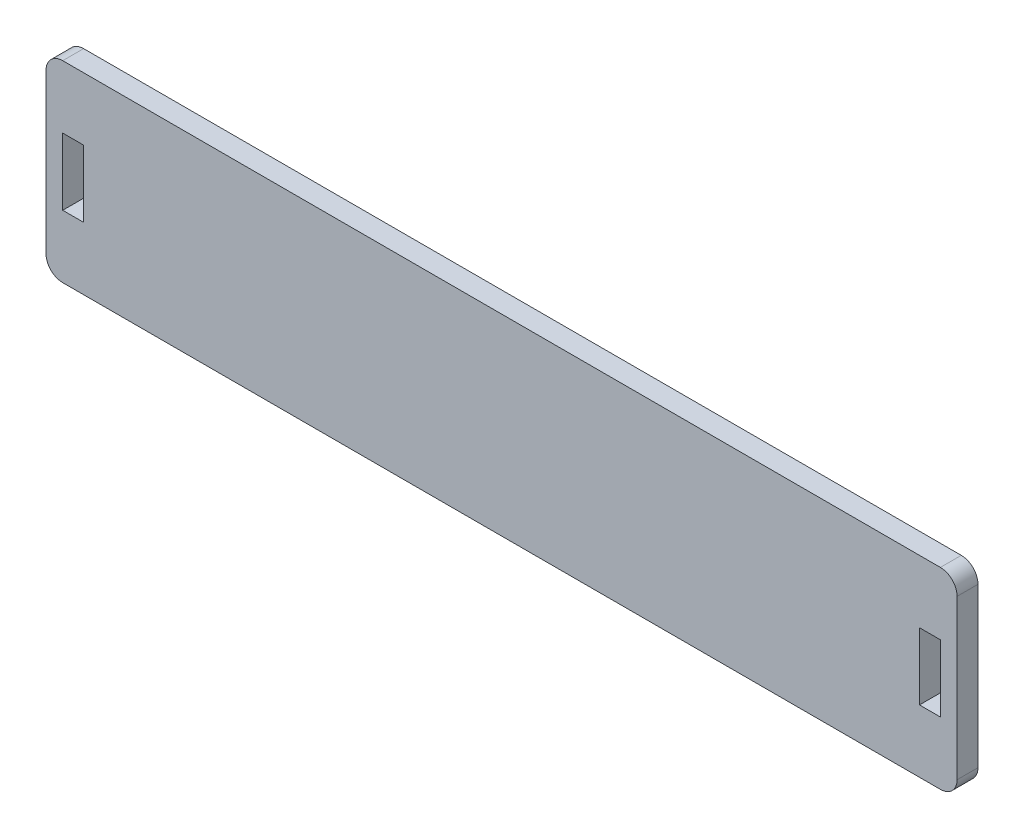
from build123d import *

# Parameters (mm, degrees)
SKETCH1_W           = 109
SKETCH1_H           = 23
SKETCH1_W_2         = 2.5
SKETCH1_H_2         = 8
BOSS_EXTRUDE1_DEPTH = 2.5
FILLET1_R           = 2
SKETCH2_W           = 0.269230769
SKETCH2_H           = 3
SKETCH2_W_2         = 0.157051282
SKETCH2_H_2         = 1.75
CUT_EXTRUDE1_DEPTH  = 1


with BuildPart() as part:
    # Sketch1 → Boss-Extrude1 (new body)
    with BuildSketch(Plane.XY):
        Rectangle(SKETCH1_W, SKETCH1_H)
        with Locations((51.25, 0)):
            Rectangle(SKETCH1_W_2, SKETCH1_H_2, mode=Mode.SUBTRACT)
        with Locations((-51.25, 0)):
            Rectangle(SKETCH1_W_2, SKETCH1_H_2, mode=Mode.SUBTRACT)
    extrude(amount=BOSS_EXTRUDE1_DEPTH)

    # Fillet1
    fillet1_edges = [part.edges().sort_by_distance(p)[0] for p in [
        (54.5, -11.5, 1.25),
        (-54.5, -11.5, 1.25),
        (-54.5, 11.5, 1.25),
        (54.5, 11.5, 1.25),
    ]]
    fillet(fillet1_edges, radius=FILLET1_R)

    # Sketch2 → Cut-Extrude1 (cut)
    # profile 1 of 19: a face of its own
    with BuildSketch(Plane(origin=(0, 0, 0), x_dir=(-1, 0, 0), z_dir=(0, 0, -1))):
        with BuildLine():
            add(Edge.make_bspline(
                [(-7.807692308, 4.576923077), (-7.752142503, 4.575516095), (-7.643038102, 4.572752665), (-7.48268819, 4.551599148), (-7.32960668, 4.515003099), (-7.182546561, 4.4662634), (-7.043266867, 4.401245355), (-6.910719244, 4.322658085), (-6.785219067, 4.229678264), (-6.668457883, 4.123024641), (-6.561609068, 4.00698168), (-6.467472594, 3.883143472), (-6.3885792, 3.752258784), (-6.323791382, 3.614720929), (-6.272964002, 3.470840956), (-6.237890536, 3.319851811), (-6.215486408, 3.162731791), (-6.21286717, 3.055565907), (-6.211538462, 3.001201923)],
                knots=[0, 0, 0, 0, 1.065120563, 2.091984664, 3.0946048, 4.079830382, 5.057816894, 6.036188127, 7.030412546, 8.04752943, 9.064399622, 10.05169764, 11.02544977, 11.989514704, 12.962713494, 13.945757189, 14.957906945, 16, 16, 16, 16], degree=3))
            add(Edge.make_bspline(
                [(-6.211538462, 3.001201923), (-6.212866975, 2.947238398), (-6.215485629, 2.840870037), (-6.23791601, 2.684747085), (-6.27309401, 2.534669345), (-6.323319381, 2.390887357), (-6.387798363, 2.253249445), (-6.467217081, 2.122117771), (-6.56076669, 1.997449343), (-6.667229705, 1.880609916), (-6.783287741, 1.773469227), (-6.907770827, 1.680110191), (-7.037879387, 1.599775227), (-7.175287708, 1.535674935), (-7.318173454, 1.48444186), (-7.467815445, 1.449511034), (-7.623512492, 1.426979283), (-7.729687638, 1.424391984), (-7.783653846, 1.423076923)],
                knots=[0, 0, 0, 0, 1.043624062, 2.057103931, 3.04512605, 4.022047818, 4.998200453, 5.980619268, 6.982898556, 8.009068085, 9.034988726, 10.034168286, 11.015286542, 11.987931943, 12.962482838, 13.94673481, 14.956375938, 16, 16, 16, 16], degree=3))
            add(Edge.make_bspline(
                [(-7.783653846, 1.423076923), (-7.838017548, 1.424404969), (-7.945182876, 1.427022901), (-8.102500335, 1.449464105), (-8.253595544, 1.484556651), (-8.398036416, 1.534707596), (-8.535903499, 1.599522366), (-8.667466427, 1.678554691), (-8.792197125, 1.77233224), (-8.909061479, 1.878760733), (-9.015989363, 1.994622063), (-9.109211685, 2.11876571), (-9.188261782, 2.248756102), (-9.252858924, 2.384953979), (-9.303999889, 2.52670093), (-9.338889733, 2.674942482), (-9.361463407, 2.828833487), (-9.364064704, 2.933613115), (-9.365384615, 2.986778846)],
                knots=[0, 0, 0, 0, 1.053102029, 2.075944431, 3.073151272, 4.055350789, 5.033113405, 6.020478099, 7.024410459, 8.052272461, 9.079885166, 10.07527673, 11.055994387, 12.023226415, 12.992069828, 13.970394897, 14.97016774, 16, 16, 16, 16], degree=3))
            add(Edge.make_bspline(
                [(-9.365384615, 2.986778846), (-9.364926356, 3.022463991), (-9.36401562, 3.093384097), (-9.353051312, 3.198698326), (-9.337141282, 3.302318889), (-9.314339643, 3.403951131), (-9.284518214, 3.50334626), (-9.249330762, 3.601189771), (-9.206353752, 3.696490106), (-9.157770339, 3.789698727), (-9.103545932, 3.879362647), (-9.043652433, 3.964116575), (-8.980193545, 4.044671715), (-8.910624922, 4.118940576), (-8.837239398, 4.18908371), (-8.758846502, 4.254023181), (-8.675924578, 4.314344568), (-8.588116824, 4.36870486), (-8.497586874, 4.417869833), (-8.404263922, 4.460059991), (-8.309415432, 4.496270901), (-8.212597163, 4.525620179), (-8.114066215, 4.548790496), (-8.013607543, 4.564568228), (-7.911301177, 4.5755605), (-7.84237719, 4.576466931), (-7.807692308, 4.576923077)],
                knots=[0, 0, 0, 0, 1.037015668, 2.060948919, 3.074880161, 4.083647147, 5.086022904, 6.090072063, 7.104153813, 8.122640571, 9.144368836, 10.147691507, 11.138137339, 12.123020368, 13.103399296, 14.087645067, 15.080126199, 16.082011238, 17.087798457, 18.072939717, 19.057185487, 20.037253025, 21.01195951, 21.997135196, 22.992090687, 24, 24, 24, 24], degree=3))
        make_face()
        with BuildLine():
            add(Edge.make_bspline(
                [(-7.794471154, 4.269230769), (-7.82294084, 4.26888372), (-7.879608039, 4.268192941), (-7.963851928, 4.259093756), (-8.046987871, 4.24612528), (-8.129033038, 4.227626833), (-8.209644144, 4.202423359), (-8.289572579, 4.173416867), (-8.368089482, 4.138084503), (-8.444935646, 4.098165042), (-8.519434282, 4.053980253), (-8.589730883, 4.00514731), (-8.656007435, 3.952811406), (-8.718101664, 3.896850403), (-8.77583124, 3.836979316), (-8.830332413, 3.774105799), (-8.879420625, 3.70643275), (-8.924408263, 3.635795258), (-8.964666412, 3.562285331), (-9.000465287, 3.486676878), (-9.029748723, 3.408353146), (-9.05363076, 3.328163868), (-9.073430598, 3.246236046), (-9.085973961, 3.161948175), (-9.095173127, 3.075723794), (-9.095824423, 3.017453633), (-9.096153846, 2.987980769)],
                knots=[0, 0, 0, 0, 1.008559885, 2.007477868, 2.99961109, 3.989939068, 4.984837346, 5.991145699, 7.001802488, 8.033829008, 9.059044045, 10.069351652, 11.065060232, 12.050310815, 13.029377138, 14.011219647, 14.996725999, 15.989392538, 16.977580475, 17.965360261, 18.951710183, 19.937753436, 20.929683414, 21.935841486, 22.955955122, 24, 24, 24, 24], degree=3))
            add(Edge.make_bspline(
                [(-9.096153846, 2.987980769), (-9.095061107, 2.944641723), (-9.092911352, 2.859380411), (-9.074090578, 2.734436288), (-9.045100314, 2.614360614), (-9.002365428, 2.499810406), (-8.948922044, 2.389801021), (-8.882898996, 2.285308359), (-8.804676922, 2.186304181), (-8.715822471, 2.093479665), (-8.618688722, 2.00875469), (-8.515546382, 1.934386054), (-8.407500433, 1.871462983), (-8.294269116, 1.820201492), (-8.17645694, 1.779581717), (-8.053304754, 1.75174289), (-7.925632931, 1.733421071), (-7.838606655, 1.731661566), (-7.794471154, 1.730769231)],
                knots=[0, 0, 0, 0, 1.032063989, 2.030389145, 3.003944642, 3.970395727, 4.937377036, 5.913328081, 6.909231446, 7.93887556, 8.970685674, 9.976071282, 10.964166581, 11.944589148, 12.933237628, 13.927779006, 14.949070134, 16, 16, 16, 16], degree=3))
            add(Edge.make_bspline(
                [(-7.794471154, 1.730769231), (-7.764805867, 1.731176806), (-7.705970693, 1.73198515), (-7.618460245, 1.740126873), (-7.532526349, 1.753182761), (-7.448289538, 1.771980466), (-7.365845414, 1.795506643), (-7.284849868, 1.823456124), (-7.206165619, 1.858325727), (-7.128800044, 1.896852543), (-7.054746123, 1.940772678), (-6.984052809, 1.987948235), (-6.918501969, 2.040207052), (-6.856454194, 2.095336606), (-6.798487603, 2.154448475), (-6.744994188, 2.217465808), (-6.696154075, 2.284786372), (-6.651183521, 2.35531672), (-6.611066439, 2.429027793), (-6.576112925, 2.504910374), (-6.546459111, 2.582777611), (-6.522520393, 2.662741815), (-6.503761426, 2.744651114), (-6.49083578, 2.828615181), (-6.481794261, 2.914466046), (-6.481112767, 2.972532208), (-6.480769231, 3.001802885)],
                knots=[0, 0, 0, 0, 1.047197238, 2.076906641, 3.100256066, 4.114471768, 5.12198147, 6.126382909, 7.136867548, 8.15857795, 9.17633901, 10.174870724, 11.156907918, 12.133735059, 13.104061851, 14.077631395, 15.04955518, 16.038496417, 17.029181396, 18.010275684, 18.986308667, 19.968651475, 20.955262928, 21.950658345, 22.966943676, 24, 24, 24, 24], degree=3))
            add(Edge.make_bspline(
                [(-6.480769231, 3.001802885), (-6.481113042, 3.030873317), (-6.481795055, 3.088539874), (-6.490831461, 3.173792004), (-6.503775082, 3.2571519), (-6.522428831, 3.338292302), (-6.54647182, 3.417233895), (-6.576118104, 3.493902536), (-6.611076932, 3.568583846), (-6.651198267, 3.641093244), (-6.696297544, 3.71067159), (-6.745578324, 3.777187944), (-6.79989148, 3.839393151), (-6.857685215, 3.898822889), (-6.920403117, 3.954209651), (-6.987761083, 4.005571812), (-7.058941379, 4.054148904), (-7.13430758, 4.097970814), (-7.212088112, 4.138440156), (-7.291900076, 4.173112445), (-7.372839304, 4.202574261), (-7.454699972, 4.227703089), (-7.538171096, 4.246052829), (-7.622688664, 4.259105443), (-7.708135743, 4.268189774), (-7.76560136, 4.26888267), (-7.794471154, 4.269230769)],
                knots=[0, 0, 0, 0, 1.02996197, 2.043119294, 3.035359645, 4.018872909, 4.991431989, 5.957985074, 6.929999688, 7.912076566, 8.892894881, 9.867085534, 10.843653904, 11.817741046, 12.803660682, 13.806313499, 14.818574707, 15.856120519, 16.894564902, 17.924820532, 18.937903209, 19.946497019, 20.957711757, 21.963978472, 22.977135795, 24, 24, 24, 24], degree=3))
        make_face(mode=Mode.SUBTRACT)
    # profile 2 of 19: a face of its own
    with BuildSketch(Plane(origin=(0, 0, 0), x_dir=(-1, 0, 0), z_dir=(0, 0, -1))):
        with BuildLine():
            Line((-5.596153846, 4.5), (-5.0078125, 4.5))
            add(Edge.make_bspline(
                [(-5.0078125, 4.5), (-4.967346009, 4.499955518), (-4.889810415, 4.499870287), (-4.778626082, 4.497286219), (-4.677646312, 4.493834769), (-4.587088842, 4.489050289), (-4.506675044, 4.483396069), (-4.436768787, 4.475465749), (-4.376820596, 4.467185496), (-4.340900782, 4.458767148), (-4.324519231, 4.454927885)],
                knots=[0, 0, 0, 0, 1.415646017, 2.712440637, 3.8905458, 4.950247383, 5.884950622, 6.709939814, 7.411656543, 8, 8, 8, 8], degree=3))
            add(Edge.make_bspline(
                [(-4.324519231, 4.454927885), (-4.303781916, 4.449251928), (-4.262795936, 4.43803376), (-4.203737899, 4.415564855), (-4.147548888, 4.388922999), (-4.094036124, 4.358559622), (-4.043857196, 4.323171995), (-3.996263446, 4.284194609), (-3.951674892, 4.24072755), (-3.91034227, 4.193258344), (-3.872383872, 4.142583879), (-3.839701287, 4.087947682), (-3.812335092, 4.030269422), (-3.788863717, 3.969589218), (-3.771970756, 3.905397512), (-3.759244842, 3.83814033), (-3.751167447, 3.767824881), (-3.750393822, 3.719773566), (-3.75, 3.6953125)],
                knots=[0, 0, 0, 0, 0.999701418, 1.975846123, 2.934577507, 3.890451536, 4.834027766, 5.787354733, 6.749476667, 7.726910423, 8.712836071, 9.690891519, 10.682875813, 11.679750201, 12.712814741, 13.765529915, 14.8625177, 16, 16, 16, 16], degree=3))
            add(Edge.make_bspline(
                [(-3.75, 3.6953125), (-3.750361221, 3.670645834), (-3.751067975, 3.622383837), (-3.759550505, 3.551778589), (-3.770976384, 3.484305684), (-3.788545286, 3.420114726), (-3.811555863, 3.359586923), (-3.838549051, 3.301797295), (-3.871106363, 3.247729005), (-3.908516217, 3.197185762), (-3.950131869, 3.150120122), (-3.995777244, 3.106873156), (-4.045268067, 3.067698009), (-4.098447051, 3.032506857), (-4.155832635, 3.00211576), (-4.216554481, 2.974895213), (-4.281140381, 2.952034304), (-4.325833964, 2.940008537), (-4.348557692, 2.933894231)],
                knots=[0, 0, 0, 0, 1.121902311, 2.195077645, 3.232258892, 4.234102512, 5.217864754, 6.176164875, 7.132989551, 8.084763148, 9.034132444, 9.988522005, 10.94243251, 11.903244335, 12.886203696, 13.894208494, 14.929344452, 16, 16, 16, 16], degree=3))
            add(Edge.make_bspline(
                [(-4.348557692, 2.933894231), (-4.36735255, 2.92989739), (-4.408542573, 2.921138081), (-4.476379192, 2.911359403), (-4.555360952, 2.903012888), (-4.645380049, 2.89675477), (-4.746355682, 2.891397312), (-4.858342474, 2.887138946), (-4.981560254, 2.884799071), (-5.067507035, 2.884678391), (-5.112379808, 2.884615385)],
                knots=[0, 0, 0, 0, 0.601384939, 1.31797006, 2.144135048, 3.087295005, 4.142315834, 5.309527816, 6.595305764, 8, 8, 8, 8], degree=3))
            Line((-5.112379808, 2.884615385), (-5.326923077, 2.884615385))
            Line((-5.326923077, 2.884615385), (-5.326923077, 1.5))
            Line((-5.326923077, 1.5), (-5.596153846, 1.5))
            Line((-5.596153846, 1.5), (-5.596153846, 4.5))
        make_face()
        with BuildLine():
            Line((-5.326923077, 4.192307692), (-5.326923077, 3.192307692))
            Line((-5.326923077, 3.192307692), (-4.801682692, 3.185697115))
            add(Edge.make_bspline(
                [(-4.801682692, 3.185697115), (-4.776037042, 3.185683861), (-4.726528642, 3.185658273), (-4.655011879, 3.189074179), (-4.588661061, 3.193017493), (-4.527679997, 3.198791142), (-4.472041196, 3.206952219), (-4.421651885, 3.215190852), (-4.376902786, 3.227109734), (-4.324532041, 3.243158079), (-4.266174886, 3.270528893), (-4.202688416, 3.31025737), (-4.148885056, 3.360897977), (-4.102326516, 3.417836118), (-4.065378621, 3.481178229), (-4.038330627, 3.548951603), (-4.022438207, 3.620461188), (-4.020307184, 3.669393879), (-4.019230769, 3.694110577)],
                knots=[0, 0, 0, 0, 1.160613943, 2.240541288, 3.23993089, 4.169200891, 5.011653406, 5.7853311, 6.478053781, 7.106038997, 8.262395093, 9.384106736, 10.481365981, 11.59014053, 12.70357646, 13.786202915, 14.881775077, 16, 16, 16, 16], degree=3))
            add(Edge.make_bspline(
                [(-4.019230769, 3.694110577), (-4.020313038, 3.718229303), (-4.022464453, 3.766174345), (-4.038455193, 3.836441854), (-4.065326034, 3.903501029), (-4.102574543, 3.966049388), (-4.147781226, 4.022782648), (-4.20032352, 4.0720659), (-4.260077744, 4.111684502), (-4.315661942, 4.137255887), (-4.365034387, 4.15286898), (-4.407918924, 4.163793129), (-4.456339503, 4.172515077), (-4.510311885, 4.179577508), (-4.569417743, 4.185623332), (-4.63416487, 4.189725598), (-4.704307992, 4.192126846), (-4.753002767, 4.192245951), (-4.778245192, 4.192307692)],
                knots=[0, 0, 0, 0, 1.120700087, 2.227813068, 3.331159281, 4.466773991, 5.599788987, 6.693661531, 7.80175334, 8.91857717, 9.525282508, 10.207424825, 10.974604443, 11.810962634, 12.737642355, 13.736264703, 14.826523623, 16, 16, 16, 16], degree=3))
            Line((-4.778245192, 4.192307692), (-5.326923077, 4.192307692))
        make_face(mode=Mode.SUBTRACT)
    # profile 3 of 19: a face of its own
    with BuildSketch(Plane(origin=(0, 0, 0), x_dir=(-1, 0, 0), z_dir=(0, 0, -1))):
        with BuildLine():
            Line((-3.134615385, 4.5), (-2.546274038, 4.5))
            add(Edge.make_bspline(
                [(-2.546274038, 4.5), (-2.505807547, 4.499955518), (-2.428271954, 4.499870287), (-2.31708762, 4.497286219), (-2.21610785, 4.493834769), (-2.125550381, 4.489050289), (-2.045136582, 4.483396069), (-1.975230326, 4.475465749), (-1.915282135, 4.467185496), (-1.879362321, 4.458767148), (-1.862980769, 4.454927885)],
                knots=[0, 0, 0, 0, 1.415646017, 2.712440637, 3.8905458, 4.950247383, 5.884950622, 6.709939814, 7.411656543, 8, 8, 8, 8], degree=3))
            add(Edge.make_bspline(
                [(-1.862980769, 4.454927885), (-1.842243455, 4.449251928), (-1.801257474, 4.43803376), (-1.742199437, 4.415564855), (-1.686010427, 4.388922999), (-1.632497662, 4.358559622), (-1.582318734, 4.323171995), (-1.534724985, 4.284194609), (-1.49013643, 4.24072755), (-1.448803808, 4.193258344), (-1.410845411, 4.142583879), (-1.378162825, 4.087947682), (-1.350796631, 4.030269422), (-1.327325255, 3.969589218), (-1.310432294, 3.905397512), (-1.29770638, 3.83814033), (-1.289628985, 3.767824881), (-1.288855361, 3.719773566), (-1.288461538, 3.6953125)],
                knots=[0, 0, 0, 0, 0.999701418, 1.975846123, 2.934577507, 3.890451536, 4.834027766, 5.787354733, 6.749476667, 7.726910423, 8.712836071, 9.690891519, 10.682875813, 11.679750201, 12.712814741, 13.765529915, 14.8625177, 16, 16, 16, 16], degree=3))
            add(Edge.make_bspline(
                [(-1.288461538, 3.6953125), (-1.28882276, 3.670645834), (-1.289529513, 3.622383837), (-1.298012044, 3.551778589), (-1.309437922, 3.484305684), (-1.327006824, 3.420114726), (-1.350017401, 3.359586923), (-1.377010589, 3.301797295), (-1.409567901, 3.247729005), (-1.446977755, 3.197185762), (-1.488593407, 3.150120122), (-1.534238783, 3.106873156), (-1.583729605, 3.067698009), (-1.636908589, 3.032506857), (-1.694294174, 3.00211576), (-1.75501602, 2.974895213), (-1.81960192, 2.952034304), (-1.864295503, 2.940008537), (-1.887019231, 2.933894231)],
                knots=[0, 0, 0, 0, 1.121902311, 2.195077645, 3.232258892, 4.234102512, 5.217864754, 6.176164875, 7.132989551, 8.084763148, 9.034132444, 9.988522005, 10.94243251, 11.903244335, 12.886203696, 13.894208494, 14.929344452, 16, 16, 16, 16], degree=3))
            add(Edge.make_bspline(
                [(-1.887019231, 2.933894231), (-1.905814088, 2.92989739), (-1.947004112, 2.921138081), (-2.014840731, 2.911359403), (-2.09382249, 2.903012888), (-2.183841587, 2.89675477), (-2.28481722, 2.891397312), (-2.396804012, 2.887138946), (-2.520021793, 2.884799071), (-2.605968573, 2.884678391), (-2.650841346, 2.884615385)],
                knots=[0, 0, 0, 0, 0.601384939, 1.31797006, 2.144135048, 3.087295005, 4.142315834, 5.309527816, 6.595305764, 8, 8, 8, 8], degree=3))
            Line((-2.650841346, 2.884615385), (-2.865384615, 2.884615385))
            Line((-2.865384615, 2.884615385), (-2.865384615, 1.5))
            Line((-2.865384615, 1.5), (-3.134615385, 1.5))
            Line((-3.134615385, 1.5), (-3.134615385, 4.5))
        make_face()
        with BuildLine():
            Line((-2.865384615, 4.192307692), (-2.865384615, 3.192307692))
            Line((-2.865384615, 3.192307692), (-2.340144231, 3.185697115))
            add(Edge.make_bspline(
                [(-2.340144231, 3.185697115), (-2.31449858, 3.185683861), (-2.26499018, 3.185658273), (-2.193473417, 3.189074179), (-2.1271226, 3.193017493), (-2.066141535, 3.198791142), (-2.010502734, 3.206952219), (-1.960113424, 3.215190852), (-1.915364324, 3.227109734), (-1.86299358, 3.243158079), (-1.804636425, 3.270528893), (-1.741149954, 3.31025737), (-1.687346595, 3.360897977), (-1.640788055, 3.417836118), (-1.603840159, 3.481178229), (-1.576792166, 3.548951603), (-1.560899745, 3.620461188), (-1.558768722, 3.669393879), (-1.557692308, 3.694110577)],
                knots=[0, 0, 0, 0, 1.160613943, 2.240541288, 3.23993089, 4.169200891, 5.011653406, 5.7853311, 6.478053781, 7.106038997, 8.262395093, 9.384106736, 10.481365981, 11.59014053, 12.70357646, 13.786202915, 14.881775077, 16, 16, 16, 16], degree=3))
            add(Edge.make_bspline(
                [(-1.557692308, 3.694110577), (-1.558774576, 3.718229303), (-1.560925992, 3.766174345), (-1.576916732, 3.836441854), (-1.603787572, 3.903501029), (-1.641036082, 3.966049388), (-1.686242765, 4.022782648), (-1.738785059, 4.0720659), (-1.798539283, 4.111684502), (-1.854123481, 4.137255887), (-1.903495926, 4.15286898), (-1.946380463, 4.163793129), (-1.994801041, 4.172515077), (-2.048773423, 4.179577508), (-2.107879281, 4.185623332), (-2.172626408, 4.189725598), (-2.242769531, 4.192126846), (-2.291464306, 4.192245951), (-2.316706731, 4.192307692)],
                knots=[0, 0, 0, 0, 1.120700087, 2.227813068, 3.331159281, 4.466773991, 5.599788987, 6.693661531, 7.80175334, 8.91857717, 9.525282508, 10.207424825, 10.974604443, 11.810962634, 12.737642355, 13.736264703, 14.826523623, 16, 16, 16, 16], degree=3))
            Line((-2.316706731, 4.192307692), (-2.865384615, 4.192307692))
        make_face(mode=Mode.SUBTRACT)
    # profile 4 of 19: a face of its own
    with BuildSketch(Plane(origin=(0, 0, 0), x_dir=(-1, 0, 0), z_dir=(0, 0, -1))):
        with BuildLine():
            add(Edge.make_bspline(
                [(0.730769231, 4.576923077), (0.786319036, 4.575516095), (0.895423436, 4.572752665), (1.055773348, 4.551599148), (1.208854859, 4.515003099), (1.355914978, 4.4662634), (1.495194672, 4.401245355), (1.627742294, 4.322658085), (1.753242472, 4.229678264), (1.870003656, 4.123024641), (1.97685247, 4.00698168), (2.070988944, 3.883143472), (2.149882339, 3.752258784), (2.214670156, 3.614720929), (2.265497536, 3.470840956), (2.300571002, 3.319851811), (2.322975131, 3.162731791), (2.325594369, 3.055565907), (2.326923077, 3.001201923)],
                knots=[0, 0, 0, 0, 1.065120563, 2.091984664, 3.0946048, 4.079830382, 5.057816894, 6.036188127, 7.030412546, 8.04752943, 9.064399622, 10.05169764, 11.02544977, 11.989514704, 12.962713494, 13.945757189, 14.957906945, 16, 16, 16, 16], degree=3))
            add(Edge.make_bspline(
                [(2.326923077, 3.001201923), (2.325594563, 2.947238398), (2.322975909, 2.840870037), (2.300545528, 2.684747085), (2.265367528, 2.534669345), (2.215142157, 2.390887357), (2.150663176, 2.253249445), (2.071244458, 2.122117771), (1.977694849, 1.997449343), (1.871231833, 1.880609916), (1.755173797, 1.773469227), (1.630690712, 1.680110191), (1.500582152, 1.599775227), (1.36317383, 1.535674935), (1.220288084, 1.48444186), (1.070646093, 1.449511034), (0.914949047, 1.426979283), (0.808773901, 1.424391984), (0.754807692, 1.423076923)],
                knots=[0, 0, 0, 0, 1.043624062, 2.057103931, 3.04512605, 4.022047818, 4.998200453, 5.980619268, 6.982898556, 8.009068085, 9.034988726, 10.034168286, 11.015286542, 11.987931943, 12.962482838, 13.94673481, 14.956375938, 16, 16, 16, 16], degree=3))
            add(Edge.make_bspline(
                [(0.754807692, 1.423076923), (0.70044399, 1.424404969), (0.593278662, 1.427022901), (0.435961203, 1.449464105), (0.284865994, 1.484556651), (0.140425122, 1.534707596), (0.002558039, 1.599522366), (-0.129004889, 1.678554691), (-0.253735586, 1.77233224), (-0.37059994, 1.878760733), (-0.477527824, 1.994622063), (-0.570750146, 2.11876571), (-0.649800244, 2.248756102), (-0.714397386, 2.384953979), (-0.765538351, 2.52670093), (-0.800428195, 2.674942482), (-0.823001868, 2.828833487), (-0.825603165, 2.933613115), (-0.826923077, 2.986778846)],
                knots=[0, 0, 0, 0, 1.053102029, 2.075944431, 3.073151272, 4.055350789, 5.033113405, 6.020478099, 7.024410459, 8.052272461, 9.079885166, 10.07527673, 11.055994387, 12.023226415, 12.992069828, 13.970394897, 14.97016774, 16, 16, 16, 16], degree=3))
            add(Edge.make_bspline(
                [(-0.826923077, 2.986778846), (-0.826464818, 3.022463991), (-0.825554081, 3.093384097), (-0.814589773, 3.198698326), (-0.798679744, 3.302318889), (-0.775878104, 3.403951131), (-0.746056675, 3.50334626), (-0.710869223, 3.601189771), (-0.667892213, 3.696490106), (-0.6193088, 3.789698727), (-0.565084394, 3.879362647), (-0.505190894, 3.964116575), (-0.441732007, 4.044671715), (-0.372163384, 4.118940576), (-0.298777859, 4.18908371), (-0.220384964, 4.254023181), (-0.13746304, 4.314344568), (-0.049655286, 4.36870486), (0.040874664, 4.417869833), (0.134197616, 4.460059991), (0.229046106, 4.496270901), (0.325864376, 4.525620179), (0.424395323, 4.548790496), (0.524853996, 4.564568228), (0.627160361, 4.5755605), (0.696084349, 4.576466931), (0.730769231, 4.576923077)],
                knots=[0, 0, 0, 0, 1.037015668, 2.060948919, 3.074880161, 4.083647147, 5.086022904, 6.090072063, 7.104153813, 8.122640571, 9.144368836, 10.147691507, 11.138137339, 12.123020368, 13.103399296, 14.087645067, 15.080126199, 16.082011238, 17.087798457, 18.072939717, 19.057185487, 20.037253025, 21.01195951, 21.997135196, 22.992090687, 24, 24, 24, 24], degree=3))
        make_face()
        with BuildLine():
            add(Edge.make_bspline(
                [(0.743990385, 4.269230769), (0.715520699, 4.26888372), (0.658853499, 4.268192941), (0.574609611, 4.259093756), (0.491473668, 4.24612528), (0.4094285, 4.227626833), (0.328817395, 4.202423359), (0.24888896, 4.173416867), (0.170372056, 4.138084503), (0.093525892, 4.098165042), (0.019027256, 4.053980253), (-0.051269345, 4.00514731), (-0.117545897, 3.952811406), (-0.179640125, 3.896850403), (-0.237369701, 3.836979316), (-0.291870874, 3.774105799), (-0.340959087, 3.70643275), (-0.385946724, 3.635795258), (-0.426204873, 3.562285331), (-0.462003749, 3.486676878), (-0.491287185, 3.408353146), (-0.515169221, 3.328163868), (-0.534969059, 3.246236046), (-0.547512423, 3.161948175), (-0.556711588, 3.075723794), (-0.557362884, 3.017453633), (-0.557692308, 2.987980769)],
                knots=[0, 0, 0, 0, 1.008559885, 2.007477868, 2.99961109, 3.989939068, 4.984837346, 5.991145699, 7.001802488, 8.033829008, 9.059044045, 10.069351652, 11.065060232, 12.050310815, 13.029377138, 14.011219647, 14.996725999, 15.989392538, 16.977580475, 17.965360261, 18.951710183, 19.937753436, 20.929683414, 21.935841486, 22.955955122, 24, 24, 24, 24], degree=3))
            add(Edge.make_bspline(
                [(-0.557692308, 2.987980769), (-0.556599569, 2.944641723), (-0.554449814, 2.859380411), (-0.535629039, 2.734436288), (-0.506638775, 2.614360614), (-0.46390389, 2.499810406), (-0.410460506, 2.389801021), (-0.344437457, 2.285308359), (-0.266215384, 2.186304181), (-0.177360932, 2.093479665), (-0.080227184, 2.00875469), (0.022915156, 1.934386054), (0.130961105, 1.871462983), (0.244192422, 1.820201492), (0.362004598, 1.779581717), (0.485156785, 1.75174289), (0.612828607, 1.733421071), (0.699854883, 1.731661566), (0.743990385, 1.730769231)],
                knots=[0, 0, 0, 0, 1.032063989, 2.030389145, 3.003944642, 3.970395727, 4.937377036, 5.913328081, 6.909231446, 7.93887556, 8.970685674, 9.976071282, 10.964166581, 11.944589148, 12.933237628, 13.927779006, 14.949070134, 16, 16, 16, 16], degree=3))
            add(Edge.make_bspline(
                [(0.743990385, 1.730769231), (0.773655672, 1.731176806), (0.832490846, 1.73198515), (0.920001293, 1.740126873), (1.005935189, 1.753182761), (1.090172001, 1.771980466), (1.172616125, 1.795506643), (1.25361167, 1.823456124), (1.332295919, 1.858325727), (1.409661494, 1.896852543), (1.483715416, 1.940772678), (1.554408729, 1.987948235), (1.619959569, 2.040207052), (1.682007344, 2.095336606), (1.739973935, 2.154448475), (1.79346735, 2.217465808), (1.842307463, 2.284786372), (1.887278018, 2.35531672), (1.9273951, 2.429027793), (1.962348613, 2.504910374), (1.992002427, 2.582777611), (2.015941145, 2.662741815), (2.034700113, 2.744651114), (2.047625758, 2.828615181), (2.056667277, 2.914466046), (2.057348772, 2.972532208), (2.057692308, 3.001802885)],
                knots=[0, 0, 0, 0, 1.047197238, 2.076906641, 3.100256066, 4.114471768, 5.12198147, 6.126382909, 7.136867548, 8.15857795, 9.17633901, 10.174870724, 11.156907918, 12.133735059, 13.104061851, 14.077631395, 15.04955518, 16.038496417, 17.029181396, 18.010275684, 18.986308667, 19.968651475, 20.955262928, 21.950658345, 22.966943676, 24, 24, 24, 24], degree=3))
            add(Edge.make_bspline(
                [(2.057692308, 3.001802885), (2.057348497, 3.030873317), (2.056666484, 3.088539874), (2.047630077, 3.173792004), (2.034686457, 3.2571519), (2.016032707, 3.338292302), (1.991989718, 3.417233895), (1.962343435, 3.493902536), (1.927384607, 3.568583846), (1.887263272, 3.641093244), (1.842163994, 3.71067159), (1.792883214, 3.777187944), (1.738570059, 3.839393151), (1.680776323, 3.898822889), (1.618058421, 3.954209651), (1.550700455, 4.005571812), (1.47952016, 4.054148904), (1.404153958, 4.097970814), (1.326373426, 4.138440156), (1.246561462, 4.173112445), (1.165622234, 4.202574261), (1.083761566, 4.227703089), (1.000290442, 4.246052829), (0.915772875, 4.259105443), (0.830325796, 4.268189774), (0.772860179, 4.26888267), (0.743990385, 4.269230769)],
                knots=[0, 0, 0, 0, 1.02996197, 2.043119294, 3.035359645, 4.018872909, 4.991431989, 5.957985074, 6.929999688, 7.912076566, 8.892894881, 9.867085534, 10.843653904, 11.817741046, 12.803660682, 13.806313499, 14.818574707, 15.856120519, 16.894564902, 17.924820532, 18.937903209, 19.946497019, 20.957711757, 21.963978472, 22.977135795, 24, 24, 24, 24], degree=3))
        make_face(mode=Mode.SUBTRACT)
    # profile 5 of 19: a face of its own
    with BuildSketch(Plane(origin=(0, 0, 0), x_dir=(-1, 0, 0), z_dir=(0, 0, -1))):
        with BuildLine():
            Line((2.634615385, 2.078725962), (2.888221154, 2.230769231))
            add(Edge.make_bspline(
                [(2.888221154, 2.230769231), (2.911808214, 2.191285472), (2.957000112, 2.115636115), (3.032386991, 2.013414937), (3.110500915, 1.926533088), (3.191920344, 1.855495996), (3.276148299, 1.799568379), (3.363734631, 1.759966466), (3.454384183, 1.735267059), (3.51607603, 1.732266985), (3.546875, 1.730769231)],
                knots=[0, 0, 0, 0, 1.272034388, 2.437168799, 3.508375237, 4.49857839, 5.41946034, 6.295179144, 7.148887113, 8, 8, 8, 8], degree=3))
            add(Edge.make_bspline(
                [(3.546875, 1.730769231), (3.573178023, 1.731501807), (3.625323829, 1.732954142), (3.702091466, 1.746909115), (3.776647296, 1.768348083), (3.8474547, 1.799051738), (3.913536655, 1.836199012), (3.971485251, 1.881067164), (4.02158192, 1.931301054), (4.062561161, 1.98734333), (4.094001191, 2.047615171), (4.118165821, 2.109480273), (4.131575884, 2.173910474), (4.133595959, 2.217290871), (4.134615385, 2.239182692)],
                knots=[0, 0, 0, 0, 1.095163259, 2.171163733, 3.241058638, 4.321873601, 5.38011039, 6.391990106, 7.366004449, 8.327778327, 9.272591725, 10.192022065, 11.087607919, 12, 12, 12, 12], degree=3))
            add(Edge.make_bspline(
                [(4.134615385, 2.239182692), (4.13335169, 2.264160563), (4.130782783, 2.314936926), (4.109070085, 2.389850914), (4.074913588, 2.463987402), (4.043402751, 2.50984563), (4.027043269, 2.533653846)],
                knots=[0, 0, 0, 0, 0.938893495, 1.908633276, 2.914225137, 4, 4, 4, 4], degree=3))
            add(Edge.make_bspline(
                [(4.027043269, 2.533653846), (4.013611314, 2.550836838), (3.985412605, 2.586910379), (3.936934737, 2.640606296), (3.880049496, 2.695993512), (3.816703592, 2.755186989), (3.744589516, 2.815433672), (3.665965932, 2.879606482), (3.578825481, 2.945264976), (3.517711627, 2.989298604), (3.486177885, 3.012019231)],
                knots=[0, 0, 0, 0, 0.722233717, 1.516239348, 2.393582979, 3.351407094, 4.387010283, 5.505090956, 6.712668013, 8, 8, 8, 8], degree=3))
            add(Edge.make_bspline(
                [(3.486177885, 3.012019231), (3.454614459, 3.034500877), (3.394267594, 3.077484074), (3.309874523, 3.141276317), (3.234407841, 3.199599634), (3.168202969, 3.253003073), (3.111289029, 3.301493877), (3.063217534, 3.344606396), (3.025213056, 3.383506591), (3.004079702, 3.408742027), (2.994591346, 3.420072115)],
                knots=[0, 0, 0, 0, 1.452282411, 2.77665338, 3.964542531, 5.026858415, 5.96415736, 6.766646006, 7.446254459, 8, 8, 8, 8], degree=3))
            add(Edge.make_bspline(
                [(2.994591346, 3.420072115), (2.981329165, 3.437730147), (2.955247304, 3.472457036), (2.9208193, 3.526735485), (2.89155716, 3.582298284), (2.868618018, 3.63929474), (2.849301259, 3.696924679), (2.836308747, 3.755940032), (2.828173264, 3.816075991), (2.827340133, 3.856544706), (2.826923077, 3.876802885)],
                knots=[0, 0, 0, 0, 1.068054152, 2.10047183, 3.106115577, 4.101338837, 5.06977816, 6.043150881, 7.020423561, 8, 8, 8, 8], degree=3))
            add(Edge.make_bspline(
                [(2.826923077, 3.876802885), (2.828041827, 3.908542691), (2.830255416, 3.971343889), (2.848975859, 4.063084601), (2.878524054, 4.150672958), (2.919919672, 4.233241816), (2.973283118, 4.308641228), (3.03503681, 4.377738503), (3.108589512, 4.435825859), (3.189291761, 4.486579052), (3.277625794, 4.52630413), (3.370189426, 4.556270685), (3.467129773, 4.573250049), (3.532789603, 4.575686704), (3.566105769, 4.576923077)],
                knots=[0, 0, 0, 0, 1.005424448, 1.989358655, 2.955360095, 3.929531133, 4.905563448, 5.876582895, 6.856512386, 7.866279853, 8.892233794, 9.918561126, 10.94386622, 12, 12, 12, 12], degree=3))
            add(Edge.make_bspline(
                [(3.566105769, 4.576923077), (3.601457855, 4.575703747), (3.671761871, 4.573278889), (3.775175484, 4.552195291), (3.874741813, 4.517309001), (3.95483604, 4.477718722), (4.017521264, 4.438177509), (4.065326463, 4.402160517), (4.113769992, 4.360696138), (4.163242611, 4.313673927), (4.212906033, 4.260662426), (4.263497564, 4.202024693), (4.315135508, 4.138119073), (4.348354817, 4.092498073), (4.365384615, 4.069110577)],
                knots=[0, 0, 0, 0, 1.286793592, 2.559021753, 3.825965368, 5.121522368, 5.803751409, 6.523245864, 7.299691795, 8.125521123, 9.008227632, 9.944561021, 10.946284179, 12, 12, 12, 12], degree=3))
            Line((4.365384615, 4.069110577), (4.121995192, 3.884615385))
            add(Edge.make_bspline(
                [(4.121995192, 3.884615385), (4.107298679, 3.903548548), (4.07899663, 3.940009393), (4.036028498, 3.991070521), (3.995529657, 4.037713218), (3.955629314, 4.078226185), (3.918434773, 4.114828013), (3.882334451, 4.146164948), (3.847847865, 4.17254403), (3.804376227, 4.200695652), (3.74976104, 4.228601227), (3.681202866, 4.252214722), (3.609557487, 4.266404775), (3.56076066, 4.268280965), (3.536057692, 4.269230769)],
                knots=[0, 0, 0, 0, 1.181633172, 2.275549214, 3.290209073, 4.226197932, 5.078386478, 5.862611352, 6.581680152, 7.217281963, 8.414376989, 9.595101626, 10.782541182, 12, 12, 12, 12], degree=3))
            add(Edge.make_bspline(
                [(3.536057692, 4.269230769), (3.505066387, 4.268192169), (3.445302575, 4.266189327), (3.360453802, 4.244315054), (3.28408758, 4.209873459), (3.218471096, 4.161603478), (3.163839401, 4.104414056), (3.124320436, 4.038603609), (3.100534581, 3.965932978), (3.097632056, 3.91524013), (3.096153846, 3.889423077)],
                knots=[0, 0, 0, 0, 1.14458467, 2.207223713, 3.21896685, 4.227309161, 5.202851033, 6.127160689, 7.046193047, 8, 8, 8, 8], degree=3))
            add(Edge.make_bspline(
                [(3.096153846, 3.889423077), (3.096490812, 3.873350381), (3.097165294, 3.841178707), (3.106572264, 3.793648917), (3.118657403, 3.746239197), (3.13780823, 3.699162698), (3.164247062, 3.651596104), (3.198965784, 3.602720329), (3.24269148, 3.552104579), (3.276186062, 3.519183973), (3.293870192, 3.501802885)],
                knots=[0, 0, 0, 0, 0.858281714, 1.717966888, 2.583508476, 3.4729293, 4.427298488, 5.488583878, 6.674047936, 8, 8, 8, 8], degree=3))
            add(Edge.make_bspline(
                [(3.293870192, 3.501802885), (3.300437083, 3.495942577), (3.316038512, 3.482019827), (3.344560734, 3.459226443), (3.38222599, 3.431109781), (3.428050733, 3.396320653), (3.482879901, 3.355965114), (3.54671952, 3.310559161), (3.618857977, 3.258628767), (3.670048191, 3.222322304), (3.697115385, 3.203125)],
                knots=[0, 0, 0, 0, 0.420754252, 0.999615792, 1.744751191, 2.668019286, 3.750313428, 4.999500688, 6.413464383, 8, 8, 8, 8], degree=3))
            add(Edge.make_bspline(
                [(3.697115385, 3.203125), (3.729674739, 3.179432406), (3.792721416, 3.133554982), (3.882427913, 3.064627256), (3.963765463, 2.997214883), (4.037019637, 2.931748363), (4.10291413, 2.868724283), (4.160717891, 2.807384414), (4.211019902, 2.748168209), (4.265173518, 2.672248858), (4.320508792, 2.579007929), (4.368030084, 2.464769439), (4.397994382, 2.350086878), (4.401912824, 2.273006733), (4.403846154, 2.234975962)],
                knots=[0, 0, 0, 0, 1.163667725, 2.253281268, 3.268753668, 4.215851969, 5.092017293, 5.902905408, 6.650798638, 7.335211899, 8.59617414, 9.77448103, 10.901945474, 12, 12, 12, 12], degree=3))
            add(Edge.make_bspline(
                [(4.403846154, 2.234975962), (4.403282893, 2.20808022), (4.402167308, 2.154811034), (4.389343668, 2.076592397), (4.370555383, 2.00062308), (4.342237754, 1.927842126), (4.307675047, 1.856918044), (4.263818263, 1.789711272), (4.212983105, 1.724734359), (4.154668449, 1.663719938), (4.090857676, 1.607708913), (4.023414509, 1.557884003), (3.952228561, 1.516339726), (3.877686004, 1.482439004), (3.799769715, 1.455924561), (3.7185059, 1.43671353), (3.633760605, 1.424922921), (3.576160192, 1.423699125), (3.546875, 1.423076923)],
                knots=[0, 0, 0, 0, 0.983748083, 1.948392443, 2.894712957, 3.844097841, 4.80183111, 5.778335162, 6.776009319, 7.81870978, 8.863265674, 9.881300176, 10.883814829, 11.87499822, 12.874611388, 13.892143829, 14.928324115, 16, 16, 16, 16], degree=3))
            add(Edge.make_bspline(
                [(3.546875, 1.423076923), (3.524216135, 1.423515079), (3.479183769, 1.424385872), (3.412575642, 1.432084112), (3.347313136, 1.442975915), (3.28421518, 1.460267975), (3.222468828, 1.481248241), (3.162342627, 1.507081098), (3.103807438, 1.538038699), (3.046535224, 1.573434435), (2.990671645, 1.614626787), (2.936740673, 1.66260407), (2.8829728, 1.716043074), (2.830955031, 1.776394985), (2.779635193, 1.842684771), (2.730025128, 1.915532642), (2.681097942, 1.994541803), (2.650398969, 2.050140447), (2.634615385, 2.078725962)],
                knots=[0, 0, 0, 0, 0.915332311, 1.819136955, 2.706846663, 3.586547465, 4.459518054, 5.340707479, 6.227863349, 7.133153174, 8.059268498, 9.028702269, 10.047606654, 11.120612155, 12.245963614, 13.433783089, 14.680604001, 16, 16, 16, 16], degree=3))
        make_face()
    # profile 6 of 19: a face of its own
    with BuildSketch(Plane(origin=(0, 0, 0), x_dir=(-1, 0, 0), z_dir=(0, 0, -1))):
        with Locations((5.153846153, 3)):
            Rectangle(SKETCH2_W, SKETCH2_H)
    # profile 7 of 19: a face of its own
    with BuildSketch(Plane(origin=(0, 0, 0), x_dir=(-1, 0, 0), z_dir=(0, 0, -1))):
        Polygon((5.711538462, 4.192307692), (5.711538462, 4.5), (7.288461538, 4.5), (7.288461538, 4.192307692), (6.634615385, 4.192307692), (6.634615385, 1.5), (6.365384615, 1.5), (6.365384615, 4.192307692), align=None)
    # profile 8 of 19: a face of its own
    with BuildSketch(Plane(origin=(0, 0, 0), x_dir=(-1, 0, 0), z_dir=(0, 0, -1))):
        Polygon((7.75, 4.5), (9.442307692, 4.5), (9.442307692, 4.192307692), (8.019230769, 4.192307692), (8.019230769, 3.269230769), (9.442307692, 3.269230769), (9.442307692, 2.961538462), (8.019230769, 2.961538462), (8.019230769, 1.807692308), (9.442307692, 1.807692308), (9.442307692, 1.5), (7.75, 1.5), align=None)
    # profile 9 of 19: a face of its own
    with BuildSketch(Plane(origin=(0, 0, 0), x_dir=(-1, 0, 0), z_dir=(0, 0, -1))):
        Polygon((8.144230769, -0.705128205), (8.301282051, -0.705128205), (8.301282051, -1.221153846), (8.525641026, -1.221153846), (8.525641026, -1.378205128), (8.301282051, -1.378205128), (8.301282051, -2.5), (8.144230769, -2.5), (8.144230769, -1.378205128), (7.919871795, -1.378205128), (7.919871795, -1.221153846), (8.144230769, -1.221153846), align=None)
    # profile 10 of 19: a face of its own
    with BuildSketch(Plane(origin=(0, 0, 0), x_dir=(-1, 0, 0), z_dir=(0, 0, -1))):
        with BuildLine():
            Line((6.326923077, -1.221153846), (6.483974359, -1.221153846))
            Line((6.483974359, -1.221153846), (6.483974359, -1.457782452))
            add(Edge.make_bspline(
                [(6.483974359, -1.457782452), (6.500653101, -1.436313585), (6.533064898, -1.394593139), (6.588927351, -1.340598074), (6.647890755, -1.295060422), (6.711472461, -1.259369156), (6.778684306, -1.23245875), (6.849250465, -1.212569025), (6.923769848, -1.200848288), (6.974718074, -1.199437457), (7.000701122, -1.198717949)],
                knots=[0, 0, 0, 0, 1.0828784, 2.104357462, 3.088488658, 4.04616522, 5.001424249, 5.969181776, 6.964304535, 8, 8, 8, 8], degree=3))
            add(Edge.make_bspline(
                [(7.000701122, -1.198717949), (7.023396923, -1.199374538), (7.068256368, -1.200672322), (7.134287982, -1.209458849), (7.197875674, -1.224517695), (7.258659701, -1.246218153), (7.317291233, -1.273045888), (7.372902283, -1.306904406), (7.426359061, -1.346107501), (7.476317156, -1.391223576), (7.522477839, -1.44003771), (7.56240093, -1.492548862), (7.596836882, -1.547030155), (7.62467203, -1.604326201), (7.646476204, -1.663985816), (7.661983543, -1.726250036), (7.671212365, -1.790888007), (7.67245059, -1.834839367), (7.673076923, -1.857071314)],
                knots=[0, 0, 0, 0, 1.041296284, 2.058176809, 3.050446431, 4.034000596, 5.01514041, 6.003636468, 7.015969324, 8.052561599, 9.08815499, 10.094063707, 11.074456064, 12.040834395, 13.011057502, 13.983766392, 14.980127149, 16, 16, 16, 16], degree=3))
            add(Edge.make_bspline(
                [(7.673076923, -1.857071314), (7.67246418, -1.879772468), (7.671255763, -1.924542421), (7.66188326, -1.990285969), (7.646904823, -2.053529656), (7.625375732, -2.114168288), (7.597554987, -2.172160114), (7.563702707, -2.227463312), (7.523759474, -2.280060163), (7.47810891, -2.329236613), (7.428582442, -2.37453627), (7.375643697, -2.414155304), (7.320114234, -2.447425992), (7.262278151, -2.475217472), (7.201640331, -2.496163564), (7.138483693, -2.511272464), (7.072842619, -2.520589712), (7.028192043, -2.521815783), (7.005608974, -2.522435897)],
                knots=[0, 0, 0, 0, 1.038740735, 2.04854663, 3.033179607, 4.009277356, 4.987731542, 5.972001279, 6.972200261, 8.005528982, 9.039189865, 10.040446548, 11.026516639, 11.997840187, 12.972163198, 13.956796175, 14.96660207, 16, 16, 16, 16], degree=3))
            add(Edge.make_bspline(
                [(7.005608974, -2.522435897), (6.980195188, -2.521788494), (6.92999551, -2.520509681), (6.856596675, -2.507549976), (6.785958249, -2.488181508), (6.718862837, -2.459832011), (6.654778931, -2.423704254), (6.594069028, -2.379649151), (6.536410651, -2.327758838), (6.501706273, -2.28839293), (6.483974359, -2.268279247)],
                knots=[0, 0, 0, 0, 1.014726462, 2.004382257, 2.969841629, 3.936926163, 4.907207904, 5.903978561, 6.929055279, 8, 8, 8, 8], degree=3))
            Line((6.483974359, -2.268279247), (6.483974359, -2.971153846))
            Line((6.483974359, -2.971153846), (6.326923077, -2.971153846))
            Line((6.326923077, -2.971153846), (6.326923077, -1.221153846))
        make_face()
        with BuildLine():
            add(Edge.make_bspline(
                [(6.999298878, -1.355769231), (6.981509097, -1.35608936), (6.946485603, -1.356719612), (6.895149494, -1.364206586), (6.84570178, -1.375075457), (6.798640804, -1.391531407), (6.753515496, -1.411730813), (6.710673413, -1.436971819), (6.67014463, -1.466797822), (6.632031114, -1.500637494), (6.597599468, -1.537924838), (6.567118004, -1.577718742), (6.541514351, -1.619968812), (6.520263341, -1.664281493), (6.5040917, -1.711004136), (6.49261384, -1.759870642), (6.485398663, -1.810934499), (6.484454195, -1.845712502), (6.483974359, -1.86338141)],
                knots=[0, 0, 0, 0, 1.05670511, 2.080379991, 3.077984906, 4.06214886, 5.038337365, 6.01289324, 7.01187578, 8.025460281, 9.038092164, 10.024533457, 11.000252242, 11.969694649, 12.940728589, 13.933144304, 14.949937299, 16, 16, 16, 16], degree=3))
            add(Edge.make_bspline(
                [(6.483974359, -1.86338141), (6.484769787, -1.886575467), (6.486328098, -1.932014587), (6.498996782, -1.998406648), (6.519614414, -2.061232476), (6.548878771, -2.119962994), (6.585852558, -2.173954412), (6.630401636, -2.222299715), (6.682122912, -2.264695011), (6.740156507, -2.300405638), (6.802367573, -2.329399671), (6.867260529, -2.350156776), (6.933942969, -2.36294289), (6.979027129, -2.3645663), (7.001752804, -2.365384615)],
                knots=[0, 0, 0, 0, 1.03728447, 2.032128127, 3.01272805, 3.987917167, 4.958271349, 5.931593992, 6.91984656, 7.941419022, 8.973179163, 9.983609215, 10.983593296, 12, 12, 12, 12], degree=3))
            add(Edge.make_bspline(
                [(7.001752804, -2.365384615), (7.024020688, -2.364606427), (7.068218435, -2.363061863), (7.133297496, -2.349692769), (7.196542815, -2.329270257), (7.256632901, -2.299490478), (7.313044645, -2.262995449), (7.363985422, -2.219215433), (7.408488879, -2.168470461), (7.446421056, -2.11196621), (7.476986799, -2.051378518), (7.499951919, -1.988687824), (7.513206205, -1.924115112), (7.5150846, -1.880616256), (7.516025641, -1.858824119)],
                knots=[0, 0, 0, 0, 1.00104056, 1.986885549, 2.97790532, 3.984399681, 4.995088187, 5.994304198, 6.996462723, 8.023150851, 9.048424203, 10.043036403, 11.019596776, 12, 12, 12, 12], degree=3))
            add(Edge.make_bspline(
                [(7.516025641, -1.858824119), (7.515298274, -1.836896624), (7.513849207, -1.793212472), (7.499575688, -1.728831021), (7.478125699, -1.665887033), (7.446846174, -1.606126758), (7.409745539, -1.549739716), (7.36487204, -1.499962777), (7.314563942, -1.456377441), (7.25821936, -1.420369736), (7.197749147, -1.391726988), (7.134091689, -1.370785169), (7.067569888, -1.358198294), (7.022256061, -1.356586041), (6.999298878, -1.355769231)],
                knots=[0, 0, 0, 0, 0.983928682, 1.960191568, 2.949917689, 3.96440592, 4.982380491, 5.975291189, 6.965713506, 7.964880129, 8.970154049, 9.96478489, 10.968906225, 12, 12, 12, 12], degree=3))
        make_face(mode=Mode.SUBTRACT)
    # profile 11 of 19: a face of its own
    with BuildSketch(Plane(origin=(0, 0, 0), x_dir=(-1, 0, 0), z_dir=(0, 0, -1))):
        Polygon((4.913461538, -1.221153846), (5.082782452, -1.221153846), (5.51572516, -2.200620994), (5.955328526, -1.221153846), (6.125, -1.221153846), (5.33974359, -2.971153846), (5.170072115, -2.971153846), (5.430538862, -2.390975561), align=None)
    # profile 12 of 19: a face of its own
    with BuildSketch(Plane(origin=(0, 0, 0), x_dir=(-1, 0, 0), z_dir=(0, 0, -1))):
        with BuildLine():
            Line((4.532051282, -1.221153846), (4.689102564, -1.221153846))
            Line((4.689102564, -1.221153846), (4.689102564, -2.236027644))
            add(Edge.make_bspline(
                [(4.689102564, -2.236027644), (4.688964043, -2.257646442), (4.688696663, -2.299375928), (4.686771178, -2.359715068), (4.682710839, -2.41544811), (4.678106498, -2.46682924), (4.67148314, -2.513620295), (4.663394957, -2.555960897), (4.654277117, -2.593891678), (4.646267008, -2.617254099), (4.642477965, -2.628305288)],
                knots=[0, 0, 0, 0, 1.307562039, 2.523909702, 3.650326591, 4.686913197, 5.643429486, 6.506965704, 7.293745905, 8, 8, 8, 8], degree=3))
            add(Edge.make_bspline(
                [(4.642477965, -2.628305288), (4.636883345, -2.642670249), (4.625861382, -2.670970668), (4.605218565, -2.711087828), (4.582101614, -2.748861023), (4.555698238, -2.784079749), (4.526127836, -2.816567205), (4.49408709, -2.847029205), (4.458951994, -2.874821288), (4.420742638, -2.899463937), (4.380339822, -2.921657464), (4.337766771, -2.940880748), (4.293263552, -2.957624169), (4.246412106, -2.970165567), (4.197946989, -2.981032928), (4.147298273, -2.988105271), (4.094761875, -2.9929188), (4.059039185, -2.993363916), (4.040915465, -2.993589744)],
                knots=[0, 0, 0, 0, 0.981931301, 1.934503488, 2.87077864, 3.801706999, 4.735015492, 5.667491629, 6.616593066, 7.585388521, 8.561939025, 9.551802639, 10.560317337, 11.588439944, 12.640189604, 13.723962949, 14.845264515, 16, 16, 16, 16], degree=3))
            add(Edge.make_bspline(
                [(4.040915465, -2.993589744), (4.014473097, -2.993161501), (3.96282405, -2.992325027), (3.887521553, -2.98257957), (3.816004194, -2.968802383), (3.749216965, -2.947949669), (3.687581917, -2.922431174), (3.631519979, -2.893133698), (3.581534425, -2.859539044), (3.536472589, -2.821288743), (3.495801794, -2.775806902), (3.457538149, -2.72220748), (3.420707678, -2.659674036), (3.399123359, -2.613777679), (3.387820513, -2.58974359)],
                knots=[0, 0, 0, 0, 1.157897085, 2.2616841, 3.32207898, 4.345638746, 5.321241055, 6.241986252, 7.112515963, 7.955008012, 8.825025602, 9.77857164, 10.836726669, 12, 12, 12, 12], degree=3))
            Line((3.387820513, -2.58974359), (3.544871795, -2.58974359))
            add(Edge.make_bspline(
                [(3.544871795, -2.58974359), (3.5575029, -2.609796528), (3.582195154, -2.648997552), (3.628369394, -2.69975413), (3.678972557, -2.743130812), (3.735712399, -2.778086199), (3.798825007, -2.804441095), (3.86834835, -2.823228743), (3.944848161, -2.834476877), (3.998107268, -2.835832524), (4.025841346, -2.836538462)],
                knots=[0, 0, 0, 0, 0.997731894, 1.950442991, 2.880492273, 3.800895997, 4.748200782, 5.754801363, 6.83083817, 8, 8, 8, 8], degree=3))
            add(Edge.make_bspline(
                [(4.025841346, -2.836538462), (4.053224791, -2.835823387), (4.106017333, -2.834444795), (4.181932917, -2.823223723), (4.251230386, -2.804437006), (4.313510487, -2.778132813), (4.368038371, -2.74590761), (4.415044366, -2.709907573), (4.453116705, -2.669317071), (4.478723188, -2.631926168), (4.494640497, -2.598614103), (4.504776615, -2.569937805), (4.5130136, -2.537511367), (4.519903519, -2.501443498), (4.525588975, -2.46168267), (4.529190416, -2.418137968), (4.531793322, -2.370908357), (4.531963307, -2.338161788), (4.532051282, -2.321213942)],
                knots=[0, 0, 0, 0, 1.570740765, 3.028230971, 4.391408896, 5.680370741, 6.894727393, 8.017376726, 9.065722033, 10.075533815, 10.603371122, 11.180248986, 11.817768598, 12.521299649, 13.286540596, 14.121245857, 15.027658897, 16, 16, 16, 16], degree=3))
            Line((4.532051282, -2.321213942), (4.532051282, -2.254957933))
            add(Edge.make_bspline(
                [(4.532051282, -2.254957933), (4.516110723, -2.273928834), (4.484509995, -2.311536944), (4.429936332, -2.360817762), (4.370327874, -2.403260827), (4.305786103, -2.438070144), (4.237891982, -2.465910857), (4.167380867, -2.485382337), (4.094884839, -2.497962287), (4.045758764, -2.499315945), (4.020933494, -2.5)],
                knots=[0, 0, 0, 0, 1.012485704, 2.007162095, 2.997754123, 3.998611389, 4.999708251, 5.992315798, 6.98544096, 8, 8, 8, 8], degree=3))
            add(Edge.make_bspline(
                [(4.020933494, -2.5), (4.006315359, -2.499742487), (3.97725208, -2.499230508), (3.934074706, -2.494751119), (3.891534487, -2.488251748), (3.849730636, -2.478711028), (3.808602829, -2.466465165), (3.768219033, -2.451156796), (3.72825227, -2.433849237), (3.689429021, -2.413462835), (3.652135955, -2.390781681), (3.616654363, -2.366212236), (3.583170093, -2.339883092), (3.552001848, -2.311534622), (3.523190513, -2.281207856), (3.496348579, -2.249226079), (3.471919905, -2.215142708), (3.449403211, -2.17957923), (3.429874435, -2.142298768), (3.412732249, -2.10410972), (3.397827547, -2.065093743), (3.385944846, -2.025120212), (3.376869289, -1.984214327), (3.370114176, -1.942443103), (3.36628271, -1.899677909), (3.365685248, -1.870867234), (3.365384615, -1.856370192)],
                knots=[0, 0, 0, 0, 1.028754217, 2.045334182, 3.052854819, 4.056607503, 5.061168794, 6.071104265, 7.095078842, 8.125279047, 9.155117945, 10.165957491, 11.161587969, 12.151493252, 13.128948131, 14.104219989, 15.088194871, 16.07871515, 17.064853787, 18.047899887, 19.02414258, 20.002704429, 20.980574569, 21.971845993, 22.979467364, 24, 24, 24, 24], degree=3))
            add(Edge.make_bspline(
                [(3.365384615, -1.856370192), (3.365644199, -1.841868644), (3.366162359, -1.812921715), (3.370637849, -1.769982022), (3.377021944, -1.727617305), (3.387125828, -1.686264234), (3.39928709, -1.645451858), (3.414348876, -1.60548163), (3.432458255, -1.566341375), (3.45296313, -1.528002109), (3.476005177, -1.490978302), (3.501271417, -1.455814979), (3.528792354, -1.422770893), (3.558188312, -1.391512682), (3.589818221, -1.362341935), (3.623665717, -1.335329453), (3.659397157, -1.31002244), (3.697123282, -1.286966771), (3.736261976, -1.266575648), (3.775818885, -1.24796935), (3.816318002, -1.23320229), (3.857004272, -1.22019074), (3.89859423, -1.210973143), (3.940577926, -1.203862022), (3.983099095, -1.199529661), (4.011575543, -1.198988869), (4.025841346, -1.198717949)],
                knots=[0, 0, 0, 0, 1.008818848, 2.013730394, 3.001654427, 3.987803273, 4.973046549, 5.963777569, 6.957074694, 7.972068341, 8.987420212, 9.989399531, 10.982630087, 11.977756091, 12.973280677, 13.973972381, 14.989194003, 16.018387222, 17.047741039, 18.059210846, 19.057554164, 20.045176975, 21.029480261, 22.018708529, 23.007435371, 24, 24, 24, 24], degree=3))
            add(Edge.make_bspline(
                [(4.025841346, -1.198717949), (4.049366816, -1.199396285), (4.095822389, -1.200735792), (4.164187891, -1.211246364), (4.230159011, -1.228003371), (4.294108018, -1.252011186), (4.356555844, -1.284786206), (4.417296672, -1.32795768), (4.476506239, -1.381912849), (4.513045154, -1.423289282), (4.532051282, -1.444811699)],
                knots=[0, 0, 0, 0, 0.96728863, 1.910097829, 2.838038873, 3.762875196, 4.71315279, 5.730631239, 6.819562287, 8, 8, 8, 8], degree=3))
            Line((4.532051282, -1.444811699), (4.532051282, -1.221153846))
        make_face()
        with BuildLine():
            add(Edge.make_bspline(
                [(4.038461538, -1.355769231), (4.015496187, -1.356549764), (3.970029659, -1.358095053), (3.903385488, -1.371287409), (3.839047021, -1.391960359), (3.778244307, -1.421531667), (3.721290752, -1.457578786), (3.670753342, -1.50124893), (3.626550884, -1.551122028), (3.589159415, -1.606747152), (3.559393732, -1.66675829), (3.538322022, -1.730013657), (3.52469701, -1.795491153), (3.523193184, -1.840177455), (3.522435897, -1.862680288)],
                knots=[0, 0, 0, 0, 1.026226791, 2.031711442, 3.026614839, 4.04107745, 5.047145931, 6.032893242, 7.017642609, 8.019221815, 9.021877557, 10.003543541, 10.994637589, 12, 12, 12, 12], degree=3))
            add(Edge.make_bspline(
                [(3.522435897, -1.862680288), (3.522798776, -1.879646925), (3.523512452, -1.913015337), (3.53037424, -1.961984284), (3.541464723, -2.008624441), (3.557183326, -2.052938628), (3.576659674, -2.095181026), (3.601155859, -2.135060643), (3.629981345, -2.172612996), (3.662910514, -2.207560337), (3.699198705, -2.239390821), (3.738558305, -2.267359841), (3.780935929, -2.290235202), (3.825289334, -2.310005621), (3.872694712, -2.324445155), (3.922469255, -2.335464544), (3.974965104, -2.341768923), (4.010750973, -2.342550322), (4.028996394, -2.342948718)],
                knots=[0, 0, 0, 0, 1.039728707, 2.044842319, 3.024901384, 3.974314358, 4.923051295, 5.871625912, 6.837440708, 7.820715446, 8.810779094, 9.792721783, 10.773906224, 11.758876063, 12.764959493, 13.806266761, 14.881525401, 16, 16, 16, 16], degree=3))
            add(Edge.make_bspline(
                [(4.028996394, -2.342948718), (4.047478273, -2.342564913), (4.083619392, -2.341814388), (4.13640486, -2.335362638), (4.18642123, -2.32495165), (4.233622642, -2.310170138), (4.278187312, -2.291309262), (4.319614619, -2.267440954), (4.358792843, -2.240258738), (4.394471048, -2.20855273), (4.426733131, -2.173610233), (4.454848514, -2.135587785), (4.478805739, -2.095057526), (4.498644574, -2.052024023), (4.513790176, -2.006152847), (4.523949629, -1.957558669), (4.531053001, -1.906474299), (4.531713463, -1.871469991), (4.532051282, -1.853565705)],
                knots=[0, 0, 0, 0, 1.121943988, 2.193949579, 3.223793937, 4.220241907, 5.192961521, 6.155822191, 7.11847367, 8.083710714, 9.04790392, 10.001595906, 10.949595423, 11.902125208, 12.873731292, 13.87582262, 14.913508608, 16, 16, 16, 16], degree=3))
            add(Edge.make_bspline(
                [(4.532051282, -1.853565705), (4.531381498, -1.830256778), (4.530072975, -1.784719326), (4.517724396, -1.718365942), (4.497814291, -1.655981605), (4.469890915, -1.597763617), (4.434899911, -1.544328842), (4.392754486, -1.49666692), (4.344181471, -1.454716491), (4.289320421, -1.419767395), (4.230296698, -1.391534677), (4.1685361, -1.370353791), (4.104130318, -1.358356634), (4.060477114, -1.356636662), (4.038461538, -1.355769231)],
                knots=[0, 0, 0, 0, 1.070913519, 2.092188694, 3.091357305, 4.074328408, 5.051968682, 6.018948707, 6.99050112, 7.9935919, 9.000589572, 9.992915277, 10.987769056, 12, 12, 12, 12], degree=3))
        make_face(mode=Mode.SUBTRACT)
    # profile 13 of 19: a face of its own
    with BuildSketch(Plane(origin=(0, 0, 0), x_dir=(-1, 0, 0), z_dir=(0, 0, -1))):
        Polygon((2.153846154, -0.75), (3.141025641, -0.75), (3.141025641, -0.929487179), (2.310897436, -0.929487179), (2.310897436, -1.467948718), (3.141025641, -1.467948718), (3.141025641, -1.647435897), (2.310897436, -1.647435897), (2.310897436, -2.320512821), (3.141025641, -2.320512821), (3.141025641, -2.5), (2.153846154, -2.5), align=None)
    # profile 14 of 19: a face of its own
    with BuildSketch(Plane(origin=(0, 0, 0), x_dir=(-1, 0, 0), z_dir=(0, 0, -1))):
        with BuildLine():
            Line((-0.044871795, -1.221153846), (0.112179487, -1.221153846))
            Line((0.112179487, -1.221153846), (0.112179487, -1.451822917))
            add(Edge.make_bspline(
                [(0.112179487, -1.451822917), (0.128948305, -1.430901555), (0.16148878, -1.390302924), (0.215680947, -1.336942636), (0.272952897, -1.292970024), (0.332953899, -1.257918127), (0.395765404, -1.231494814), (0.461004539, -1.212411848), (0.529061892, -1.200969434), (0.57534411, -1.199474319), (0.598758013, -1.198717949)],
                knots=[0, 0, 0, 0, 1.12780773, 2.188550248, 3.19190651, 4.159438251, 5.104880172, 6.052711206, 7.014878035, 8, 8, 8, 8], degree=3))
            add(Edge.make_bspline(
                [(0.598758013, -1.198717949), (0.62242333, -1.199590546), (0.668742064, -1.201298431), (0.736181094, -1.214806776), (0.799167791, -1.237879404), (0.857477569, -1.269485439), (0.910041176, -1.308788676), (0.956203602, -1.354577567), (0.994385225, -1.407245608), (1.019983907, -1.456107186), (1.036846731, -1.499451583), (1.047462899, -1.536574958), (1.05647839, -1.577934034), (1.064294264, -1.623403829), (1.06958282, -1.673302924), (1.073753966, -1.72742677), (1.076743313, -1.785757835), (1.076861916, -1.826101149), (1.076923077, -1.846905048)],
                knots=[0, 0, 0, 0, 1.235846778, 2.418850247, 3.575807741, 4.728682307, 5.871620074, 6.994088408, 8.11269785, 9.256955736, 9.865816715, 10.540099792, 11.271859618, 12.076849838, 12.949306005, 13.892391288, 14.913166135, 16, 16, 16, 16], degree=3))
            Line((1.076923077, -1.846905048), (1.076923077, -2.5))
            Line((1.076923077, -2.5), (0.919871795, -2.5))
            Line((0.919871795, -2.5), (0.919871795, -1.8984375))
            add(Edge.make_bspline(
                [(0.919871795, -1.8984375), (0.919775191, -1.881026278), (0.919590404, -1.847721572), (0.91900758, -1.800037061), (0.917602677, -1.756793771), (0.915628521, -1.718095088), (0.912739005, -1.683978169), (0.90972769, -1.654373531), (0.906045201, -1.62931876), (0.902763745, -1.614236219), (0.901292067, -1.607471955)],
                knots=[0, 0, 0, 0, 1.430800155, 2.736877192, 3.918605307, 4.986035426, 5.920637409, 6.731861385, 7.431261377, 8, 8, 8, 8], degree=3))
            add(Edge.make_bspline(
                [(0.901292067, -1.607471955), (0.895979302, -1.587616363), (0.885753871, -1.54940049), (0.86048688, -1.497563314), (0.828579789, -1.45346422), (0.789630865, -1.417375859), (0.744016327, -1.389290441), (0.691862755, -1.369803464), (0.633673435, -1.357615329), (0.592746244, -1.356401763), (0.571414263, -1.355769231)],
                knots=[0, 0, 0, 0, 1.084156227, 2.086665306, 3.027808233, 3.945421172, 4.874247719, 5.839848303, 6.874090471, 8, 8, 8, 8], degree=3))
            add(Edge.make_bspline(
                [(0.571414263, -1.355769231), (0.558780421, -1.356007233), (0.533778375, -1.356478234), (0.496703389, -1.361203883), (0.460741302, -1.36893311), (0.425531197, -1.379367429), (0.391777301, -1.393698564), (0.358395155, -1.409963249), (0.326641773, -1.430237355), (0.295840074, -1.452832666), (0.267183671, -1.477872269), (0.240519501, -1.504294524), (0.216750491, -1.532432326), (0.195216154, -1.5618323), (0.176627022, -1.592898219), (0.160400478, -1.625330372), (0.14663263, -1.659171447), (0.139791284, -1.682658977), (0.136368189, -1.694411058)],
                knots=[0, 0, 0, 0, 1.023777757, 2.026029729, 3.023749952, 4.003683103, 4.997618607, 5.993177895, 7.010360494, 8.046726602, 9.087585522, 10.09234134, 11.086953743, 12.070360549, 13.043493632, 14.017870808, 15.008233677, 16, 16, 16, 16], degree=3))
            add(Edge.make_bspline(
                [(0.136368189, -1.694411058), (0.134398365, -1.703038659), (0.13011016, -1.721820496), (0.12547857, -1.752642706), (0.121274783, -1.788297694), (0.117756303, -1.828743852), (0.115603595, -1.87412279), (0.113256397, -1.924240709), (0.112401866, -1.979297453), (0.112255689, -2.017628299), (0.112179487, -2.037610176)],
                knots=[0, 0, 0, 0, 0.615963638, 1.340920617, 2.168419149, 3.115676021, 4.16674242, 5.331190069, 6.6087489, 8, 8, 8, 8], degree=3))
            Line((0.112179487, -2.037610176), (0.112179487, -2.5))
            Line((0.112179487, -2.5), (-0.044871795, -2.5))
            Line((-0.044871795, -2.5), (-0.044871795, -1.221153846))
        make_face()
    # profile 15 of 19: a face of its own
    with BuildSketch(Plane(origin=(0, 0, 0), x_dir=(-1, 0, 0), z_dir=(0, 0, -1))):
        with Locations((-0.52724359, -1.625)):
            Rectangle(SKETCH2_W_2, SKETCH2_H_2)
    # profile 16 of 19: a face of its own
    with BuildSketch(Plane(origin=(0, 0, 0), x_dir=(-1, 0, 0), z_dir=(0, 0, -1))):
        with BuildLine():
            Line((-1.844651442, -2.096153846), (-1.705128205, -2.169421074))
            add(Edge.make_bspline(
                [(-1.705128205, -2.169421074), (-1.716246503, -2.189142739), (-1.737878307, -2.227513291), (-1.775078681, -2.280229221), (-1.814074717, -2.327653079), (-1.856626701, -2.368517906), (-1.901461541, -2.404143599), (-1.948827868, -2.435312511), (-1.998972277, -2.461871771), (-2.051897139, -2.484248035), (-2.108046915, -2.501452782), (-2.167557673, -2.513604893), (-2.230543421, -2.521116527), (-2.273716511, -2.521989097), (-2.295823317, -2.522435897)],
                knots=[0, 0, 0, 0, 1.120438281, 2.179929193, 3.190490725, 4.156257408, 5.095198341, 6.022838206, 6.959905092, 7.901321166, 8.864066838, 9.862729781, 10.905609505, 12, 12, 12, 12], degree=3))
            add(Edge.make_bspline(
                [(-2.295823317, -2.522435897), (-2.320394306, -2.52186231), (-2.368325187, -2.520743406), (-2.43809506, -2.511097174), (-2.50378477, -2.495360995), (-2.565390621, -2.473378224), (-2.622761748, -2.444664562), (-2.676012175, -2.409684821), (-2.725421938, -2.368618694), (-2.769434043, -2.321110472), (-2.809055984, -2.270269493), (-2.844018894, -2.217291551), (-2.873247609, -2.162309939), (-2.897023915, -2.105674677), (-2.916226347, -2.04774273), (-2.929609699, -1.987986996), (-2.937324573, -1.926569204), (-2.938506796, -1.885020536), (-2.939102564, -1.864082532)],
                knots=[0, 0, 0, 0, 1.145258523, 2.234067595, 3.276747158, 4.290159414, 5.277019952, 6.260822364, 7.254936242, 8.264827045, 9.274100331, 10.257902744, 11.220704747, 12.172965371, 13.118907548, 14.062713208, 15.023725156, 16, 16, 16, 16], degree=3))
            add(Edge.make_bspline(
                [(-2.939102564, -1.864082532), (-2.938572993, -1.844435117), (-2.937523454, -1.805496534), (-2.930908061, -1.747863762), (-2.919183914, -1.691849536), (-2.903095752, -1.637407312), (-2.882320129, -1.584628245), (-2.856904019, -1.533480213), (-2.826807831, -1.484017643), (-2.803571494, -1.452816076), (-2.791866987, -1.437099359)],
                knots=[0, 0, 0, 0, 1.024358464, 2.0301432, 3.019427413, 4.004406732, 4.986367066, 5.972626655, 6.978780325, 8, 8, 8, 8], degree=3))
            add(Edge.make_bspline(
                [(-2.791866987, -1.437099359), (-2.776013146, -1.418164924), (-2.744807672, -1.380895849), (-2.692029495, -1.331926686), (-2.634879397, -1.290904798), (-2.574073584, -1.25690123), (-2.508905347, -1.231064407), (-2.440250701, -1.211810616), (-2.367327908, -1.20102161), (-2.317475298, -1.199497693), (-2.291967147, -1.198717949)],
                knots=[0, 0, 0, 0, 1.030682036, 2.02871468, 2.997146059, 3.962720338, 4.930598197, 5.918074684, 6.934738563, 8, 8, 8, 8], degree=3))
            add(Edge.make_bspline(
                [(-2.291967147, -1.198717949), (-2.265743345, -1.199394973), (-2.214298222, -1.200723141), (-2.139282161, -1.213036308), (-2.068301803, -1.232562585), (-2.001385551, -1.26013948), (-1.93852662, -1.295719256), (-1.880133596, -1.339790177), (-1.825207839, -1.39099922), (-1.79325355, -1.430380825), (-1.776993189, -1.450420673)],
                knots=[0, 0, 0, 0, 1.056321875, 2.072262726, 3.055038591, 4.01806755, 4.982017516, 5.957941055, 6.960871419, 8, 8, 8, 8], degree=3))
            add(Edge.make_bspline(
                [(-1.776993189, -1.450420673), (-1.76592972, -1.465522464), (-1.743876423, -1.495625523), (-1.716252873, -1.544711102), (-1.692274176, -1.596066399), (-1.673107695, -1.650521547), (-1.657587945, -1.707431337), (-1.646359535, -1.76720261), (-1.639774726, -1.829817566), (-1.638480377, -1.872480843), (-1.637820513, -1.894230769)],
                knots=[0, 0, 0, 0, 0.94817472, 1.890038105, 2.849395472, 3.817997239, 4.812318967, 5.836947057, 6.897266129, 8, 8, 8, 8], degree=3))
            Line((-1.637820513, -1.894230769), (-2.782051282, -1.894230769))
            add(Edge.make_bspline(
                [(-2.782051282, -1.894230769), (-2.781281479, -1.911081001), (-2.779767692, -1.944216303), (-2.77271012, -1.992701695), (-2.761585733, -2.038888366), (-2.745951202, -2.082429887), (-2.727017779, -2.123894951), (-2.703824921, -2.162975969), (-2.676155144, -2.199494934), (-2.645292294, -2.233778503), (-2.610938747, -2.264308883), (-2.574797373, -2.291634772), (-2.536350591, -2.31453757), (-2.495901549, -2.333127515), (-2.453515656, -2.347680673), (-2.409179559, -2.357614583), (-2.362980501, -2.364268137), (-2.331487634, -2.365007969), (-2.315454728, -2.365384615)],
                knots=[0, 0, 0, 0, 1.094153842, 2.151609401, 3.174256925, 4.172055639, 5.149267565, 6.128595816, 7.11444997, 8.118368179, 9.117203808, 10.09244225, 11.054858984, 12.015122123, 12.976791628, 13.957293641, 14.960065497, 16, 16, 16, 16], degree=3))
            add(Edge.make_bspline(
                [(-2.315454728, -2.365384615), (-2.299779154, -2.365080587), (-2.268675808, -2.364477337), (-2.22235538, -2.358611381), (-2.176785616, -2.349126243), (-2.132155124, -2.336181248), (-2.089369701, -2.320392822), (-2.049746926, -2.301341393), (-2.013306818, -2.28026652), (-1.979248335, -2.256161682), (-1.946212839, -2.226657589), (-1.913441595, -2.189839728), (-1.878303269, -2.146295965), (-1.856308472, -2.113523132), (-1.844651442, -2.096153846)],
                knots=[0, 0, 0, 0, 0.99110716, 1.966546729, 2.947904876, 3.932708344, 4.903319531, 5.828989031, 6.710028674, 7.56322171, 8.463672341, 9.504779593, 10.677557249, 12, 12, 12, 12], degree=3))
        make_face()
        with BuildLine():
            add(Edge.make_bspline(
                [(-1.794871795, -1.737179487), (-1.800620107, -1.71634805), (-1.811683758, -1.67625424), (-1.83480194, -1.620733795), (-1.86083771, -1.571389844), (-1.891648576, -1.528600028), (-1.926557939, -1.490598271), (-1.96688053, -1.457388979), (-2.012098477, -1.427680253), (-2.061978047, -1.402604003), (-2.11479894, -1.381259074), (-2.170102036, -1.366946516), (-2.22653093, -1.357141745), (-2.264698073, -1.356228691), (-2.283904247, -1.355769231)],
                knots=[0, 0, 0, 0, 1.154881502, 2.222775134, 3.210006277, 4.132804581, 5.035138423, 5.962687519, 6.919655026, 7.923214229, 8.944639381, 9.960483929, 10.97369054, 12, 12, 12, 12], degree=3))
            add(Edge.make_bspline(
                [(-2.283904247, -1.355769231), (-2.299578966, -1.356075067), (-2.330564591, -1.35667964), (-2.376215125, -1.362414704), (-2.420054974, -1.371894627), (-2.462407618, -1.384877105), (-2.502718052, -1.402181406), (-2.541815436, -1.42247302), (-2.578705634, -1.447243811), (-2.601776282, -1.466123239), (-2.61343149, -1.475661058)],
                knots=[0, 0, 0, 0, 1.04873581, 2.073130211, 3.073294108, 4.04793562, 5.032784715, 6.005352987, 6.992311501, 8, 8, 8, 8], degree=3))
            add(Edge.make_bspline(
                [(-2.61343149, -1.475661058), (-2.621778131, -1.483208216), (-2.638669698, -1.498481824), (-2.661239959, -1.524796427), (-2.682850196, -1.553172208), (-2.702517022, -1.58469477), (-2.720555815, -1.61900516), (-2.737435804, -1.655813977), (-2.75262901, -1.695400542), (-2.761177065, -1.722986762), (-2.76557492, -1.737179487)],
                knots=[0, 0, 0, 0, 0.879870761, 1.780643979, 2.707998968, 3.669668524, 4.684282772, 5.740141944, 6.837334558, 8, 8, 8, 8], degree=3))
            Line((-2.76557492, -1.737179487), (-1.794871795, -1.737179487))
        make_face(mode=Mode.SUBTRACT)
    # profile 17 of 19: a face of its own
    with BuildSketch(Plane(origin=(0, 0, 0), x_dir=(-1, 0, 0), z_dir=(0, 0, -1))):
        with BuildLine():
            Line((-3.253205128, -0.705128205), (-3.253205128, -2.5))
            Line((-3.253205128, -2.5), (-3.41025641, -2.5))
            Line((-3.41025641, -2.5), (-3.41025641, -2.278796074))
            add(Edge.make_bspline(
                [(-3.41025641, -2.278796074), (-3.427965806, -2.298815871), (-3.462525913, -2.337884756), (-3.520246472, -2.388925842), (-3.581430561, -2.431115003), (-3.645781222, -2.465189961), (-3.713240343, -2.490785989), (-3.783658387, -2.508979069), (-3.857064077, -2.520675986), (-3.907190255, -2.521843997), (-3.932592147, -2.522435897)],
                knots=[0, 0, 0, 0, 1.074387032, 2.096679803, 3.090159297, 4.057316773, 5.018401886, 5.985159533, 6.978961417, 8, 8, 8, 8], degree=3))
            add(Edge.make_bspline(
                [(-3.932592147, -2.522435897), (-3.955176124, -2.521822711), (-3.999712727, -2.520613481), (-4.065227265, -2.511232329), (-4.12827339, -2.496167018), (-4.188910676, -2.475216574), (-4.246746749, -2.447426163), (-4.302276797, -2.414155539), (-4.355213143, -2.374535124), (-4.404748913, -2.32924111), (-4.450364913, -2.280043616), (-4.490395549, -2.227570843), (-4.523772089, -2.172049691), (-4.55168213, -2.114183114), (-4.573180302, -2.053525654), (-4.588167119, -1.99028707), (-4.597537342, -1.924542133), (-4.598746073, -1.879772372), (-4.599358974, -1.857071314)],
                knots=[0, 0, 0, 0, 1.033919861, 2.038935746, 3.024066025, 3.998881131, 4.97069526, 5.957263378, 6.95902576, 7.993208707, 9.027059324, 10.027763471, 11.009749337, 11.988697705, 12.965288445, 13.950418724, 14.960734635, 16, 16, 16, 16], degree=3))
            add(Edge.make_bspline(
                [(-4.599358974, -1.857071314), (-4.598732489, -1.834839462), (-4.59749396, -1.790888291), (-4.58826735, -1.726248942), (-4.572751846, -1.663989811), (-4.550977922, -1.60431134), (-4.523056945, -1.547141315), (-4.489092901, -1.492439302), (-4.449083339, -1.440054603), (-4.402957135, -1.39121899), (-4.35298975, -1.346108683), (-4.299535385, -1.30690416), (-4.243923744, -1.273045736), (-4.185292239, -1.246218998), (-4.124508686, -1.224514445), (-4.061031964, -1.209497961), (-3.995126174, -1.200649301), (-3.950380928, -1.199367919), (-3.927684295, -1.198717949)],
                knots=[0, 0, 0, 0, 1.020392517, 2.01726096, 2.990465484, 3.961182959, 4.928053699, 5.906110375, 6.912531644, 7.948652711, 8.985773172, 9.998621852, 10.987621588, 11.969261332, 12.953316658, 13.946091881, 14.958173133, 16, 16, 16, 16], degree=3))
            add(Edge.make_bspline(
                [(-3.927684295, -1.198717949), (-3.901575891, -1.199501497), (-3.850327996, -1.201039514), (-3.775378735, -1.213892698), (-3.70448493, -1.235474137), (-3.637238436, -1.265019777), (-3.574040156, -1.303420153), (-3.514426836, -1.349795877), (-3.459435174, -1.40545945), (-3.426899263, -1.447265237), (-3.41025641, -1.46864984)],
                knots=[0, 0, 0, 0, 1.031072012, 2.023879775, 2.993683497, 3.952812103, 4.918022106, 5.908088563, 6.929940113, 8, 8, 8, 8], degree=3))
            Line((-3.41025641, -1.46864984), (-3.41025641, -0.705128205))
            Line((-3.41025641, -0.705128205), (-3.253205128, -0.705128205))
        make_face()
        with BuildLine():
            add(Edge.make_bspline(
                [(-3.925580929, -1.355769231), (-3.948538098, -1.35658605), (-3.993851898, -1.35819832), (-4.060373899, -1.370785068), (-4.124030606, -1.391727365), (-4.184503644, -1.420368316), (-4.240837752, -1.456382684), (-4.291184587, -1.499943375), (-4.335955938, -1.549861883), (-4.37361007, -1.605912938), (-4.404305319, -1.666001983), (-4.425888835, -1.728814202), (-4.440123458, -1.793216691), (-4.441577719, -1.836898034), (-4.442307692, -1.858824119)],
                knots=[0, 0, 0, 0, 1.031046209, 2.035121221, 3.029706178, 4.034933723, 5.034054252, 6.02443088, 7.017295772, 8.038157696, 9.050218397, 10.03989886, 11.016116709, 12, 12, 12, 12], degree=3))
            add(Edge.make_bspline(
                [(-4.442307692, -1.858824119), (-4.441375246, -1.880619172), (-4.439514007, -1.92412385), (-4.42613866, -1.988614138), (-4.403698723, -2.05144116), (-4.373077692, -2.112071656), (-4.33473438, -2.168363706), (-4.290290053, -2.219233768), (-4.239314913, -2.262978562), (-4.182851159, -2.299597349), (-4.122547174, -2.329178609), (-4.059130208, -2.349761429), (-3.993792389, -2.363050319), (-3.949366222, -2.364602558), (-3.926983173, -2.365384615)],
                knots=[0, 0, 0, 0, 0.979072187, 1.954306742, 2.945804271, 3.96968567, 4.997920485, 5.998718438, 6.996577872, 8.005894225, 9.015743152, 10.005417472, 10.995077863, 12, 12, 12, 12], degree=3))
            add(Edge.make_bspline(
                [(-3.926983173, -2.365384615), (-3.904259922, -2.364554633), (-3.859065628, -2.362903882), (-3.792346274, -2.350263249), (-3.727598793, -2.32937885), (-3.665705179, -2.300429286), (-3.608047113, -2.264550608), (-3.556298175, -2.222547063), (-3.51254019, -2.173695471), (-3.475443886, -2.120007244), (-3.446356177, -2.061151246), (-3.425168148, -1.998484151), (-3.412641195, -1.932003777), (-3.41106233, -1.886571813), (-3.41025641, -1.86338141)],
                knots=[0, 0, 0, 0, 1.01762866, 2.023962475, 3.030623092, 4.058876274, 5.077231937, 6.066672613, 7.034107872, 8.005628644, 8.981990164, 9.965428785, 10.961468474, 12, 12, 12, 12], degree=3))
            add(Edge.make_bspline(
                [(-3.41025641, -1.86338141), (-3.410736238, -1.845712495), (-3.411680692, -1.810934478), (-3.418895977, -1.75987072), (-3.43037344, -1.711003857), (-3.446546525, -1.664282512), (-3.467792167, -1.619965004), (-3.49341605, -1.577733124), (-3.523868775, -1.537806519), (-3.558660123, -1.500734983), (-3.596742724, -1.466921752), (-3.637039995, -1.436739632), (-3.680029368, -1.411945245), (-3.724987887, -1.391424609), (-3.771993554, -1.375095034), (-3.821428864, -1.364201188), (-3.872768357, -1.356721027), (-3.907791385, -1.356089837), (-3.925580929, -1.355769231)],
                knots=[0, 0, 0, 0, 1.050140795, 2.067009409, 3.05949893, 4.030605086, 5.00011959, 5.97591094, 6.962425594, 7.979863591, 8.993523472, 9.986985069, 10.967611495, 11.937549037, 12.921786183, 13.919465291, 14.943216303, 16, 16, 16, 16], degree=3))
        make_face(mode=Mode.SUBTRACT)
    # profile 18 of 19: a face of its own
    with BuildSketch(Plane(origin=(0, 0, 0), x_dir=(-1, 0, 0), z_dir=(0, 0, -1))):
        with BuildLine():
            Line((-4.913461538, -1.221153846), (-4.913461538, -2.5))
            Line((-4.913461538, -2.5), (-5.070512821, -2.5))
            Line((-5.070512821, -2.5), (-5.070512821, -2.278796074))
            add(Edge.make_bspline(
                [(-5.070512821, -2.278796074), (-5.088222216, -2.298815871), (-5.122782323, -2.337884756), (-5.180502882, -2.388925842), (-5.241686971, -2.431115003), (-5.306037632, -2.465189961), (-5.373496754, -2.490785989), (-5.443914797, -2.508979069), (-5.517320488, -2.520675986), (-5.567446665, -2.521843997), (-5.592848558, -2.522435897)],
                knots=[0, 0, 0, 0, 1.074387032, 2.096679803, 3.090159297, 4.057316773, 5.018401886, 5.985159533, 6.978961417, 8, 8, 8, 8], degree=3))
            add(Edge.make_bspline(
                [(-5.592848558, -2.522435897), (-5.615432535, -2.521822711), (-5.659969137, -2.520613481), (-5.725483676, -2.511232329), (-5.7885298, -2.496167018), (-5.849167087, -2.475216574), (-5.907003159, -2.447426163), (-5.962533208, -2.414155539), (-6.015469554, -2.374535124), (-6.065005323, -2.32924111), (-6.110621323, -2.280043616), (-6.15065196, -2.227570843), (-6.1840285, -2.172049691), (-6.21193854, -2.114183114), (-6.233436712, -2.053525654), (-6.248423529, -1.99028707), (-6.257793753, -1.924542133), (-6.259002483, -1.879772372), (-6.259615385, -1.857071314)],
                knots=[0, 0, 0, 0, 1.033919861, 2.038935746, 3.024066025, 3.998881131, 4.97069526, 5.957263378, 6.95902576, 7.993208707, 9.027059324, 10.027763471, 11.009749337, 11.988697705, 12.965288445, 13.950418724, 14.960734635, 16, 16, 16, 16], degree=3))
            add(Edge.make_bspline(
                [(-6.259615385, -1.857071314), (-6.258988899, -1.834839462), (-6.257750371, -1.790888291), (-6.248523761, -1.726248942), (-6.233008256, -1.663989811), (-6.211234332, -1.60431134), (-6.183313355, -1.547141315), (-6.149349311, -1.492439302), (-6.109339749, -1.440054603), (-6.063213546, -1.39121899), (-6.01324616, -1.346108683), (-5.959791795, -1.30690416), (-5.904180154, -1.273045736), (-5.845548649, -1.246218998), (-5.784765097, -1.224514445), (-5.721288374, -1.209497961), (-5.655382584, -1.200649301), (-5.610637338, -1.199367919), (-5.587940705, -1.198717949)],
                knots=[0, 0, 0, 0, 1.020392517, 2.01726096, 2.990465484, 3.961182959, 4.928053699, 5.906110375, 6.912531644, 7.948652711, 8.985773172, 9.998621852, 10.987621588, 11.969261332, 12.953316658, 13.946091881, 14.958173133, 16, 16, 16, 16], degree=3))
            add(Edge.make_bspline(
                [(-5.587940705, -1.198717949), (-5.561840776, -1.199436824), (-5.510660046, -1.200846506), (-5.435796041, -1.21257787), (-5.364973802, -1.232397103), (-5.297646626, -1.259355852), (-5.234056283, -1.295180217), (-5.174804791, -1.340370197), (-5.119272049, -1.394640791), (-5.087081903, -1.436326013), (-5.070512821, -1.457782452)],
                knots=[0, 0, 0, 0, 1.038897134, 2.037228247, 3.008116434, 3.962042015, 4.918381754, 5.904844433, 6.921570401, 8, 8, 8, 8], degree=3))
            Line((-5.070512821, -1.457782452), (-5.070512821, -1.221153846))
            Line((-5.070512821, -1.221153846), (-4.913461538, -1.221153846))
        make_face()
        with BuildLine():
            add(Edge.make_bspline(
                [(-5.58583734, -1.355769231), (-5.608794509, -1.35658605), (-5.654108309, -1.35819832), (-5.72063031, -1.370785068), (-5.784287017, -1.391727365), (-5.844760054, -1.420368316), (-5.901094162, -1.456382684), (-5.951440998, -1.499943375), (-5.996212348, -1.549861883), (-6.03386648, -1.605912938), (-6.064561729, -1.666001983), (-6.086145245, -1.728814202), (-6.100379869, -1.793216691), (-6.101834129, -1.836898034), (-6.102564103, -1.858824119)],
                knots=[0, 0, 0, 0, 1.031046209, 2.035121221, 3.029706178, 4.034933723, 5.034054252, 6.02443088, 7.017295772, 8.038157696, 9.050218397, 10.03989886, 11.016116709, 12, 12, 12, 12], degree=3))
            add(Edge.make_bspline(
                [(-6.102564103, -1.858824119), (-6.101631656, -1.880619172), (-6.099770417, -1.92412385), (-6.08639507, -1.988614138), (-6.063955134, -2.05144116), (-6.033334102, -2.112071656), (-5.99499079, -2.168363706), (-5.950546464, -2.219233768), (-5.899571323, -2.262978562), (-5.843107569, -2.299597349), (-5.782803584, -2.329178609), (-5.719386618, -2.349761429), (-5.654048799, -2.363050319), (-5.609622632, -2.364602558), (-5.587239583, -2.365384615)],
                knots=[0, 0, 0, 0, 0.979072187, 1.954306742, 2.945804271, 3.96968567, 4.997920485, 5.998718438, 6.996577872, 8.005894225, 9.015743152, 10.005417472, 10.995077863, 12, 12, 12, 12], degree=3))
            add(Edge.make_bspline(
                [(-5.587239583, -2.365384615), (-5.564516332, -2.364554633), (-5.519322039, -2.362903882), (-5.452602685, -2.350263249), (-5.387855203, -2.32937885), (-5.325961589, -2.300429286), (-5.268303524, -2.264550608), (-5.216554585, -2.222547063), (-5.172796601, -2.173695471), (-5.135700296, -2.120007244), (-5.106612587, -2.061151246), (-5.085424558, -1.998484151), (-5.072897605, -1.932003777), (-5.07131874, -1.886571813), (-5.070512821, -1.86338141)],
                knots=[0, 0, 0, 0, 1.01762866, 2.023962475, 3.030623092, 4.058876274, 5.077231937, 6.066672613, 7.034107872, 8.005628644, 8.981990164, 9.965428785, 10.961468474, 12, 12, 12, 12], degree=3))
            add(Edge.make_bspline(
                [(-5.070512821, -1.86338141), (-5.070992649, -1.845712495), (-5.071937102, -1.810934478), (-5.079152387, -1.75987072), (-5.09062985, -1.711003857), (-5.106802935, -1.664282512), (-5.128048578, -1.619965004), (-5.153672461, -1.577733124), (-5.184125185, -1.537806519), (-5.218916533, -1.500734983), (-5.256999135, -1.466921752), (-5.297296405, -1.436739632), (-5.340285779, -1.411945245), (-5.385244297, -1.391424609), (-5.432249964, -1.375095034), (-5.481685274, -1.364201188), (-5.533024768, -1.356721027), (-5.568047795, -1.356089837), (-5.58583734, -1.355769231)],
                knots=[0, 0, 0, 0, 1.050140795, 2.067009409, 3.05949893, 4.030605086, 5.00011959, 5.97591094, 6.962425594, 7.979863591, 8.993523472, 9.986985069, 10.967611495, 11.937549037, 12.921786183, 13.919465291, 14.943216303, 16, 16, 16, 16], degree=3))
        make_face(mode=Mode.SUBTRACT)
    # profile 19 of 19: a face of its own
    with BuildSketch(Plane(origin=(0, 0, 0), x_dir=(-1, 0, 0), z_dir=(0, 0, -1))):
        Polygon((-8.480769231, -2.5), (-8.249749599, -0.75), (-8.227313702, -0.75), (-7.504807692, -2.185897436), (-6.784054487, -0.75), (-6.761268029, -0.75), (-6.528846154, -2.5), (-6.686598558, -2.5), (-6.854166667, -1.240785256), (-7.485877404, -2.5), (-7.521284054, -2.5), (-8.155448718, -1.237980769), (-8.322666266, -2.5), align=None)
    extrude(amount=-CUT_EXTRUDE1_DEPTH, mode=Mode.SUBTRACT)


solid = part.part
